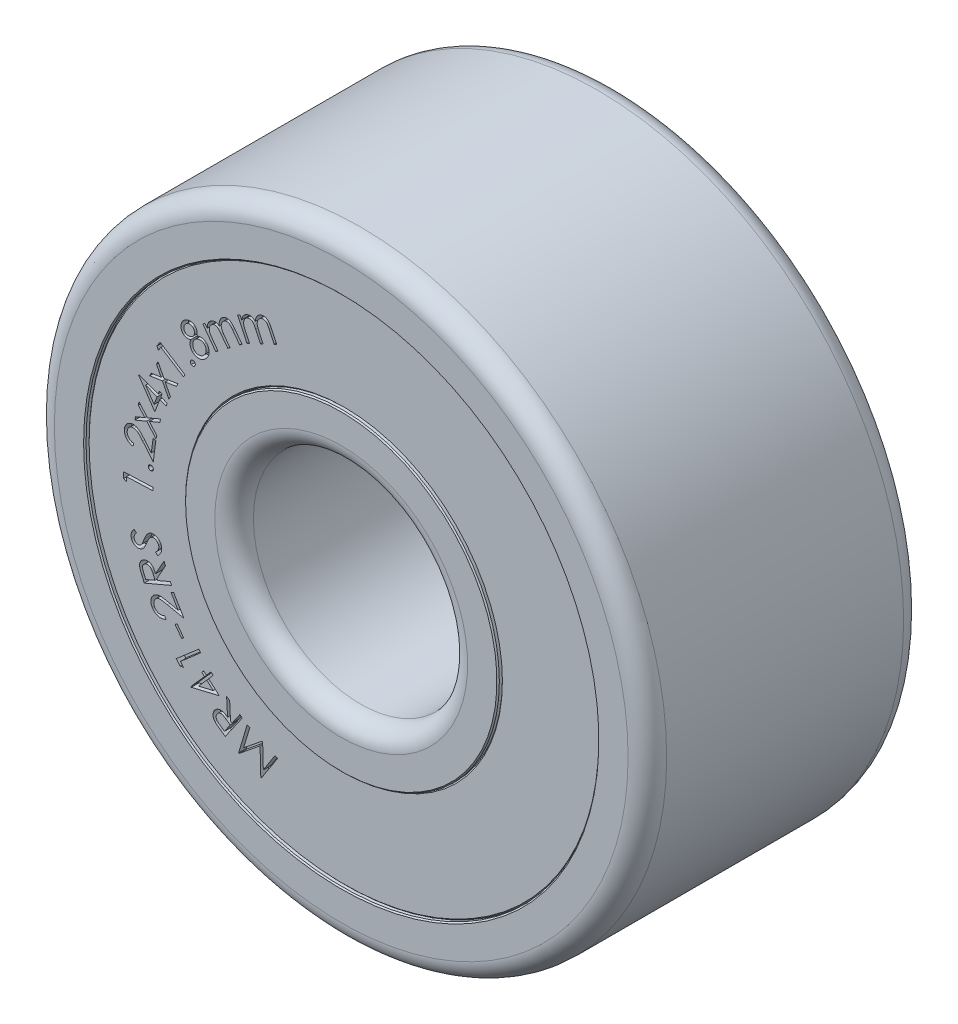
from build123d import *

# Parameters (mm, degrees)
SKETCH_R_INNER_BODY_W          = 1.8
SKETCH_R_INNER_BODY_H          = 0.325
FILLET_INNER_BODY_R            = 0.126
CHAMFER_INNER_BODY_SIZE        = 0.008
SKETCH_R_OUTER_BODY_W          = 1.8
SKETCH_R_OUTER_BODY_H          = 0.325
FILLET_OUTER_BODY_R            = 0.126
CHAMFER_OUTER_BODY_SIZE        = 0.008
SKETCH_R_SEAL_FACES_W          = 1.76
SKETCH_R_SEAL_FACES_H          = 0.65
CHAMFER_SEALS_SIZE             = 0.008
CUT_EXTRUDE_SEAL_LABEL_1_DEPTH = 0.05
CUT_EXTRUDE_SEAL_LABEL_2_DEPTH = 0.05


with BuildPart() as part:
    # Sketch R, INNER BODY → Revolve INNER BODY (revolve)
    with BuildSketch(Plane(origin=(0, 0, 0), x_dir=(0, 0, -1), z_dir=(1, 0, 0)), mode=Mode.PRIVATE) as revolve_inner_body_sk:
        with Locations((0, 0.8625)):
            Rectangle(SKETCH_R_INNER_BODY_W, SKETCH_R_INNER_BODY_H)
    revolve(revolve_inner_body_sk.sketch.rotate(Axis((0, 0, 17.5), (0, 0, -1)), 90), axis=Axis((0, 0, 17.5), (0, 0, -1)))

    # Fillet INNER BODY
    fillet_inner_body_edges = [part.edges().sort_by_distance(p)[0] for p in [
        (-0.7, 0, -0.9),
        (-0.7, 0, 0.9),
    ]]
    fillet(fillet_inner_body_edges, radius=FILLET_INNER_BODY_R)

    # Chamfer INNER BODY
    chamfer_inner_body_edges = [part.edges().sort_by_distance(p)[0] for p in [
        (-1.025, 0, 0.9),
        (-1.025, 0, -0.9),
    ]]
    chamfer(chamfer_inner_body_edges, length=CHAMFER_INNER_BODY_SIZE)


with BuildPart() as body_2:
    # Sketch R, OUTER BODY → Revolve OUTER BODY (revolve)
    with BuildSketch(Plane(origin=(0, 0, 0), x_dir=(0, 0, -1), z_dir=(1, 0, 0)), mode=Mode.PRIVATE) as revolve_outer_body_sk:
        with Locations((0, 1.8375)):
            Rectangle(SKETCH_R_OUTER_BODY_W, SKETCH_R_OUTER_BODY_H)
    revolve(revolve_outer_body_sk.sketch.rotate(Axis((0, 0, 17.5), (0, 0, -1)), 90), axis=Axis((0, 0, 17.5), (0, 0, -1)))

    # Fillet OUTER BODY
    fillet_outer_body_edges = [body_2.edges().sort_by_distance(p)[0] for p in [
        (-2, 0, 0.9),
        (-2, 0, -0.9),
    ]]
    fillet(fillet_outer_body_edges, radius=FILLET_OUTER_BODY_R)

    # Chamfer OUTER BODY
    chamfer_outer_body_edges = [body_2.edges().sort_by_distance(p)[0] for p in [
        (-1.675, 0, -0.9),
        (-1.675, 0, 0.9),
    ]]
    chamfer(chamfer_outer_body_edges, length=CHAMFER_OUTER_BODY_SIZE)


with BuildPart() as body_3:
    # Sketch R, SEAL FACES → Revolve SEALS (revolve)
    with BuildSketch(Plane(origin=(0, 0, 0), x_dir=(0, 0, -1), z_dir=(1, 0, 0)), mode=Mode.PRIVATE) as revolve_seals_sk:
        with Locations((0, 1.35)):
            Rectangle(SKETCH_R_SEAL_FACES_W, SKETCH_R_SEAL_FACES_H)
    revolve(revolve_seals_sk.sketch.rotate(Axis((0, 0, 17.5), (0, 0, -1)), 270), axis=Axis((0, 0, 17.5), (0, 0, -1)))

    # Chamfer SEALS
    chamfer_seals_edges = [body_3.edges().sort_by_distance(p)[0] for p in [
        (1.025, 0, -0.88),
        (1.025, 0, 0.88),
        (1.675, 0, 0.88),
        (1.675, 0, -0.88),
    ]]
    chamfer(chamfer_seals_edges, length=CHAMFER_SEALS_SIZE)

    # Sketch TEXT RADIUS 1 — MANUALLY ASSIGN TEXT AND FONT SIZE (FROM EQUATIONS) → Cut-Extrude SEAL LABEL 1 (cut)
    # profile 1 of 19: a face of its own
    with BuildSketch(Plane.XY.offset(0.88)):
        with BuildLine():
            Line((-0.697111191, 1.206639705), (-0.680509629, 1.214413143))
            Line((-0.680509629, 1.214413143), (-0.669962754, 1.191913143))
            add(Edge.make_bspline(
                [(-0.669962754, 1.191913143), (-0.669448735, 1.194554488), (-0.668466992, 1.199599289), (-0.666332124, 1.2066823), (-0.663828886, 1.213003689), (-0.66161166, 1.216728824), (-0.660548691, 1.218514705)],
                knots=[0, 0, 0, 0, 1.136445856, 2.170539126, 3.122931411, 4, 4, 4, 4], degree=3))
            add(Edge.make_bspline(
                [(-0.660548691, 1.218514705), (-0.658996693, 1.220689927), (-0.65593897, 1.224975514), (-0.650324386, 1.230417975), (-0.644254325, 1.23518062), (-0.639707103, 1.237504171), (-0.637423691, 1.238670955)],
                knots=[0, 0, 0, 0, 1.030723876, 2.030715377, 3.011113351, 4, 4, 4, 4], degree=3))
            add(Edge.make_bspline(
                [(-0.637423691, 1.238670955), (-0.635847952, 1.239355634), (-0.632714251, 1.240717269), (-0.627811385, 1.242153573), (-0.622808434, 1.243055273), (-0.617768732, 1.243442268), (-0.612810382, 1.243323988), (-0.608039386, 1.242755542), (-0.603513187, 1.241658864), (-0.599160158, 1.240016704), (-0.594851637, 1.237775891), (-0.590499314, 1.234801974), (-0.586056436, 1.231068469), (-0.583183727, 1.228211712), (-0.581681504, 1.22671783)],
                knots=[0, 0, 0, 0, 1.005767313, 2.000188725, 2.984730366, 3.979327312, 4.956006379, 5.886085135, 6.788957225, 7.677308091, 8.605319933, 9.627215446, 10.759201767, 12, 12, 12, 12], degree=3))
            add(Edge.make_bspline(
                [(-0.581681504, 1.22671783), (-0.581557204, 1.228295436), (-0.581312962, 1.231395334), (-0.580625583, 1.235956755), (-0.579757643, 1.240362683), (-0.578564907, 1.244578651), (-0.577191168, 1.248636518), (-0.575616084, 1.252545702), (-0.573709056, 1.256251932), (-0.57099451, 1.260968619), (-0.567012744, 1.266350162), (-0.561525166, 1.272034768), (-0.555281748, 1.27681742), (-0.550653735, 1.279218897), (-0.548322129, 1.280428768)],
                knots=[0, 0, 0, 0, 0.856908743, 1.683773241, 2.497081416, 3.287625216, 4.054859067, 4.817117057, 5.567802098, 6.310526591, 7.763473218, 9.179946501, 10.57924892, 12, 12, 12, 12], degree=3))
            add(Edge.make_bspline(
                [(-0.548322129, 1.280428768), (-0.546093559, 1.281382493), (-0.541733439, 1.283248423), (-0.534884725, 1.284846111), (-0.528052969, 1.285402851), (-0.521266799, 1.284938819), (-0.514665489, 1.283437552), (-0.508306748, 1.281019382), (-0.502391836, 1.277454557), (-0.49772577, 1.273785124), (-0.494192048, 1.27021654), (-0.491444842, 1.267088445), (-0.488723672, 1.26346428), (-0.485944247, 1.259407415), (-0.483197514, 1.25485924), (-0.480367042, 1.249899075), (-0.477573668, 1.244461533), (-0.475748235, 1.240667394), (-0.474806504, 1.238710018)],
                knots=[0, 0, 0, 0, 1.207538779, 2.362508116, 3.490021574, 4.616561488, 5.741827035, 6.856523467, 7.995154324, 9.17404587, 9.807948123, 10.498501778, 11.249478439, 12.067507475, 12.951012156, 13.899388034, 14.916305156, 16, 16, 16, 16], degree=3))
            Line((-0.474806504, 1.238710018), (-0.441525254, 1.16765533))
            Line((-0.441525254, 1.16765533), (-0.458634629, 1.159647518))
            Line((-0.458634629, 1.159647518), (-0.491915879, 1.230702205))
            add(Edge.make_bspline(
                [(-0.491915879, 1.230702205), (-0.492702876, 1.232372365), (-0.494217161, 1.235585969), (-0.496510732, 1.240151064), (-0.498734955, 1.244249294), (-0.500852391, 1.247892269), (-0.502824368, 1.251106499), (-0.504729682, 1.253855842), (-0.506572111, 1.256127202), (-0.508829534, 1.258578365), (-0.511840734, 1.26099375), (-0.515688422, 1.263388099), (-0.519991954, 1.264951194), (-0.524544491, 1.265988085), (-0.529329967, 1.266293135), (-0.534218206, 1.2658597), (-0.539177331, 1.264620864), (-0.542374718, 1.263272994), (-0.544025254, 1.262577205)],
                knots=[0, 0, 0, 0, 1.26028867, 2.424959346, 3.486876996, 4.442729345, 5.301035869, 6.060503323, 6.724036304, 7.296279004, 8.3319073, 9.34863547, 10.37541519, 11.440712446, 12.527412123, 13.633887642, 14.778580107, 16, 16, 16, 16], degree=3))
            add(Edge.make_bspline(
                [(-0.544025254, 1.262577205), (-0.545992221, 1.261560352), (-0.549881799, 1.259549577), (-0.555006751, 1.255415557), (-0.55947916, 1.250571584), (-0.563147496, 1.244983331), (-0.566052189, 1.23892089), (-0.567976274, 1.232473408), (-0.568963175, 1.225752038), (-0.568960976, 1.219915987), (-0.568394755, 1.214947136), (-0.56753735, 1.210767096), (-0.56636796, 1.206147483), (-0.564776839, 1.201098192), (-0.562835948, 1.195607505), (-0.560450557, 1.189701712), (-0.55778728, 1.183339016), (-0.555772126, 1.179002821), (-0.554728379, 1.176756893)],
                knots=[0, 0, 0, 0, 1.082217008, 2.140028542, 3.205292986, 4.300233275, 5.401433909, 6.486972192, 7.58285938, 8.71810778, 9.334382817, 10.029826271, 10.806347976, 11.667728838, 12.621865624, 13.658155093, 14.78704371, 16, 16, 16, 16], degree=3))
            Line((-0.554728379, 1.176756893), (-0.530861191, 1.12578033))
            Line((-0.530861191, 1.12578033), (-0.547501816, 1.118006893))
            Line((-0.547501816, 1.118006893), (-0.578712754, 1.184647518))
            add(Edge.make_bspline(
                [(-0.578712754, 1.184647518), (-0.579602274, 1.186526891), (-0.581308945, 1.190132735), (-0.583899497, 1.195238145), (-0.586294267, 1.199857399), (-0.588617165, 1.203938664), (-0.590782925, 1.207514048), (-0.59279921, 1.210585945), (-0.594727379, 1.213111076), (-0.59707674, 1.215786147), (-0.600123124, 1.218526735), (-0.604156734, 1.221037236), (-0.60852653, 1.222911687), (-0.613207062, 1.224071135), (-0.618085592, 1.22450982), (-0.623050294, 1.22413115), (-0.628072651, 1.223014409), (-0.6312833, 1.221641414), (-0.632931504, 1.22093658)],
                knots=[0, 0, 0, 0, 1.333306128, 2.558137195, 3.671161392, 4.669568794, 5.568888951, 6.351652075, 7.024693455, 7.604400866, 8.633448854, 9.638919357, 10.63774567, 11.670580913, 12.718361764, 13.764810914, 14.852553808, 16, 16, 16, 16], degree=3))
            add(Edge.make_bspline(
                [(-0.632931504, 1.22093658), (-0.634803609, 1.21995296), (-0.638517114, 1.218001853), (-0.643481907, 1.214019405), (-0.647820917, 1.209264268), (-0.651521925, 1.203804793), (-0.654425948, 1.197815703), (-0.656514439, 1.191462055), (-0.657540542, 1.184779308), (-0.657659469, 1.178996687), (-0.657174941, 1.174122641), (-0.656509866, 1.170101028), (-0.655479148, 1.165759638), (-0.654094697, 1.161114412), (-0.652399946, 1.15614223), (-0.650414207, 1.150832058), (-0.648066402, 1.145204338), (-0.646303646, 1.141386606), (-0.645392441, 1.139413143)],
                knots=[0, 0, 0, 0, 1.088591578, 2.159329165, 3.261934473, 4.398035035, 5.548256539, 6.684357101, 7.833578523, 9.022298784, 9.656392443, 10.357391492, 11.122927435, 11.95585434, 12.856211277, 13.831547555, 14.879082755, 16, 16, 16, 16], degree=3))
            Line((-0.645392441, 1.139413143), (-0.619533066, 1.084256893))
            Line((-0.619533066, 1.084256893), (-0.636134629, 1.076483455))
            Line((-0.636134629, 1.076483455), (-0.697111191, 1.206639705))
        make_face()
    # profile 2 of 19: a face of its own
    with BuildSketch(Plane.XY.offset(0.88)):
        with BuildLine():
            Line((-0.924466528, 1.041378299), (-0.909896216, 1.052276736))
            Line((-0.909896216, 1.052276736), (-0.895169653, 1.032550174))
            add(Edge.make_bspline(
                [(-0.895169653, 1.032550174), (-0.895190416, 1.03520825), (-0.895230188, 1.040299852), (-0.894545487, 1.04760355), (-0.893386831, 1.054242799), (-0.892002534, 1.058305524), (-0.891341528, 1.060245486)],
                knots=[0, 0, 0, 0, 1.133420946, 2.171091659, 3.126691312, 4, 4, 4, 4], degree=3))
            add(Edge.make_bspline(
                [(-0.891341528, 1.060245486), (-0.890265837, 1.062679131), (-0.888154506, 1.067455814), (-0.883820096, 1.073893164), (-0.878877103, 1.07973134), (-0.874926225, 1.08290852), (-0.872943091, 1.084503299)],
                knots=[0, 0, 0, 0, 1.034211239, 2.029917185, 3.011121626, 4, 4, 4, 4], degree=3))
            add(Edge.make_bspline(
                [(-0.872943091, 1.084503299), (-0.871541984, 1.085482476), (-0.868769391, 1.087420129), (-0.864303157, 1.089814817), (-0.859648947, 1.091742607), (-0.854822977, 1.093132115), (-0.84996756, 1.094025125), (-0.845203213, 1.094438105), (-0.840572549, 1.094287327), (-0.836021382, 1.093563382), (-0.831386297, 1.092241617), (-0.826581945, 1.090193349), (-0.821463369, 1.087539184), (-0.818105245, 1.085318211), (-0.816341528, 1.084151736)],
                knots=[0, 0, 0, 0, 1.007735125, 1.994165164, 2.982746373, 3.974605085, 4.95093366, 5.891241037, 6.790522168, 7.677082048, 8.603512504, 9.626358687, 10.753341915, 12, 12, 12, 12], degree=3))
            add(Edge.make_bspline(
                [(-0.816341528, 1.084151736), (-0.816541873, 1.085712336), (-0.816934931, 1.088774079), (-0.817208299, 1.093340896), (-0.817193779, 1.097786943), (-0.816996003, 1.102123208), (-0.816417533, 1.106332369), (-0.815642164, 1.110427796), (-0.814645876, 1.114435888), (-0.81286719, 1.119541678), (-0.810095391, 1.125569382), (-0.805873482, 1.132184951), (-0.800770188, 1.138084561), (-0.796757323, 1.141368176), (-0.794739966, 1.143018924)],
                knots=[0, 0, 0, 0, 0.858955011, 1.685184677, 2.495694609, 3.286027423, 4.053253289, 4.813197296, 5.56157936, 6.305795905, 7.762719478, 9.172851023, 10.578728335, 12, 12, 12, 12], degree=3))
            add(Edge.make_bspline(
                [(-0.794739966, 1.143018924), (-0.792772105, 1.144396142), (-0.788916092, 1.147094793), (-0.782585518, 1.150023859), (-0.776062595, 1.151985514), (-0.769365028, 1.152871887), (-0.762634862, 1.152763816), (-0.755993681, 1.15161599), (-0.749503021, 1.149426205), (-0.744262599, 1.146743514), (-0.74008605, 1.144009136), (-0.736809866, 1.141488005), (-0.733397776, 1.138562577), (-0.729940729, 1.135121506), (-0.726300356, 1.131319828), (-0.722605596, 1.127020412), (-0.718713325, 1.122357772), (-0.716196331, 1.119007347), (-0.714896216, 1.117276736)],
                knots=[0, 0, 0, 0, 1.205226785, 2.361635305, 3.488045489, 4.617189867, 5.74297253, 6.858666852, 7.990671242, 9.173082064, 9.80655761, 10.497650523, 11.249357012, 12.063847033, 12.947999547, 13.894226974, 14.912294806, 16, 16, 16, 16], degree=3))
            Line((-0.714896216, 1.117276736), (-0.668255591, 1.054932986))
            Line((-0.668255591, 1.054932986), (-0.683255591, 1.043682986))
            Line((-0.683255591, 1.043682986), (-0.729896216, 1.106026736))
            add(Edge.make_bspline(
                [(-0.729896216, 1.106026736), (-0.731015575, 1.10748526), (-0.733162509, 1.110282713), (-0.736261251, 1.114308388), (-0.739280338, 1.117823232), (-0.742036993, 1.12099026), (-0.7446604, 1.123657852), (-0.747033618, 1.125984694), (-0.749303467, 1.12779256), (-0.751977359, 1.129741518), (-0.755386531, 1.13150985), (-0.759634921, 1.132990845), (-0.764124067, 1.133716157), (-0.76876103, 1.133811925), (-0.773458615, 1.133119234), (-0.778132391, 1.131766487), (-0.782666977, 1.129512171), (-0.785504656, 1.127572738), (-0.786966528, 1.126573611)],
                knots=[0, 0, 0, 0, 1.264246233, 2.424827156, 3.492077075, 4.449714442, 5.310787415, 6.064384168, 6.732749035, 7.304130694, 8.337418261, 9.35951332, 10.385404874, 11.450963578, 12.536052193, 13.638000124, 14.783180807, 16, 16, 16, 16], degree=3))
            add(Edge.make_bspline(
                [(-0.786966528, 1.126573611), (-0.788669008, 1.125179743), (-0.792033452, 1.122425179), (-0.796212112, 1.117401001), (-0.799570688, 1.111787773), (-0.802044533, 1.105642422), (-0.803610377, 1.099153865), (-0.804204895, 1.092504238), (-0.803785556, 1.085771625), (-0.802661946, 1.080096388), (-0.801102535, 1.075383254), (-0.799428035, 1.07148662), (-0.797365925, 1.067224093), (-0.794786369, 1.062643208), (-0.791790516, 1.057705449), (-0.788334175, 1.052419074), (-0.78442613, 1.046792005), (-0.781599349, 1.042972329), (-0.780130591, 1.040987674)],
                knots=[0, 0, 0, 0, 1.083643444, 2.141498219, 3.204743247, 4.299942345, 5.396948953, 6.486972634, 7.581040523, 8.715012129, 9.330600301, 10.027423788, 10.806098678, 11.665986023, 12.620161694, 13.655477599, 14.781816143, 16, 16, 16, 16], degree=3))
            Line((-0.780130591, 1.040987674), (-0.746654028, 0.996261111))
            Line((-0.746654028, 0.996261111), (-0.761263403, 0.985323611))
            Line((-0.761263403, 0.985323611), (-0.805013403, 1.043800174))
            add(Edge.make_bspline(
                [(-0.805013403, 1.043800174), (-0.806258602, 1.045444402), (-0.808645551, 1.048596259), (-0.812152292, 1.053069214), (-0.815482055, 1.057024942), (-0.818496926, 1.0605824), (-0.821381271, 1.063564131), (-0.823923463, 1.066184282), (-0.826313636, 1.068258179), (-0.829143603, 1.070386438), (-0.832669568, 1.072407369), (-0.837073244, 1.074132676), (-0.841718462, 1.075012258), (-0.846483731, 1.075210917), (-0.851302623, 1.074674386), (-0.856043327, 1.073311877), (-0.860679374, 1.071190837), (-0.86351749, 1.069223897), (-0.864974341, 1.068214236)],
                knots=[0, 0, 0, 0, 1.33304068, 2.555335079, 3.672686028, 4.674933858, 5.567841182, 6.353320396, 7.0333571, 7.610657323, 8.639853134, 9.649457979, 10.652906318, 11.680449355, 12.722229329, 13.771831525, 14.856245744, 16, 16, 16, 16], degree=3))
            add(Edge.make_bspline(
                [(-0.864974341, 1.068214236), (-0.866598102, 1.066884141), (-0.869827038, 1.064239174), (-0.873832518, 1.059355002), (-0.877160515, 1.053885726), (-0.879609675, 1.047808407), (-0.881269394, 1.041400526), (-0.881925711, 1.034789804), (-0.881654959, 1.028080242), (-0.880578189, 1.022420621), (-0.879114768, 1.017782949), (-0.877664397, 1.014001485), (-0.875772808, 1.010015513), (-0.8735374, 1.005755182), (-0.870850507, 1.001291971), (-0.867876561, 0.996510171), (-0.86439734, 0.99156499), (-0.861945308, 0.988197573), (-0.860677466, 0.986456424)],
                knots=[0, 0, 0, 0, 1.087835896, 2.163220127, 3.26151542, 4.401791799, 5.553183353, 6.688354921, 7.838951837, 9.029956107, 9.667354108, 10.363101927, 11.131559683, 11.957386405, 12.860855637, 13.836460069, 14.881324443, 16, 16, 16, 16], degree=3))
            Line((-0.860677466, 0.986456424), (-0.824466528, 0.938057986))
            Line((-0.824466528, 0.938057986), (-0.839036841, 0.927159549))
            Line((-0.839036841, 0.927159549), (-0.924466528, 1.041378299))
        make_face()
    # profile 3 of 19: a face of its own
    with BuildSketch(Plane.XY.offset(0.88)):
        with BuildLine():
            add(Edge.make_bspline(
                [(-0.963472747, 0.954821283), (-0.961786914, 0.955415921), (-0.958494764, 0.956577149), (-0.953561938, 0.957912824), (-0.948838556, 0.959026459), (-0.944289724, 0.959836193), (-0.939913516, 0.960238031), (-0.93572452, 0.960439246), (-0.931716444, 0.960215004), (-0.927871523, 0.959771758), (-0.924166975, 0.958967459), (-0.920581068, 0.957911336), (-0.917088187, 0.956624786), (-0.913705249, 0.955065346), (-0.91046885, 0.953160456), (-0.907306686, 0.951056837), (-0.904220067, 0.948716769), (-0.90232456, 0.946935487), (-0.901363372, 0.946032221)],
                knots=[0, 0, 0, 0, 1.287908557, 2.515069266, 3.680545103, 4.785156768, 5.841228177, 6.84602376, 7.804347004, 8.730853456, 9.63270001, 10.532444753, 11.423189118, 12.313241181, 13.212985924, 14.126522896, 15.049982874, 16, 16, 16, 16], degree=3))
            add(Edge.make_bspline(
                [(-0.901363372, 0.946032221), (-0.900063101, 0.94471297), (-0.897494472, 0.942106846), (-0.894101573, 0.937856459), (-0.891091835, 0.93343824), (-0.888601398, 0.928744166), (-0.886473549, 0.923871158), (-0.884825894, 0.918755635), (-0.883657533, 0.913426667), (-0.883197511, 0.909786611), (-0.882964934, 0.907946283)],
                knots=[0, 0, 0, 0, 1.027799095, 2.030372912, 3.01485147, 3.991655742, 4.976028122, 5.963660242, 6.970473511, 8, 8, 8, 8], degree=3))
            add(Edge.make_bspline(
                [(-0.882964934, 0.907946283), (-0.882814005, 0.905667711), (-0.882514363, 0.901144018), (-0.883123537, 0.89437627), (-0.884423373, 0.887714511), (-0.886671416, 0.881192602), (-0.889653128, 0.87476449), (-0.893433286, 0.868431082), (-0.898076794, 0.862243901), (-0.901641631, 0.858346607), (-0.903472747, 0.856344721)],
                knots=[0, 0, 0, 0, 0.953812174, 1.893622043, 2.832437295, 3.786529284, 4.77091548, 5.791760922, 6.865714374, 8, 8, 8, 8], degree=3))
            add(Edge.make_bspline(
                [(-0.903472747, 0.856344721), (-0.905317797, 0.854502358), (-0.908905057, 0.850920325), (-0.914640145, 0.846226622), (-0.920418672, 0.842232793), (-0.92632722, 0.839058513), (-0.932277069, 0.83655259), (-0.938339224, 0.834851884), (-0.94448372, 0.833962339), (-0.950628261, 0.833775407), (-0.956651713, 0.834227597), (-0.962450064, 0.835124497), (-0.967986516, 0.836441392), (-0.973247629, 0.838241796), (-0.978223216, 0.840522571), (-0.98294104, 0.843226074), (-0.987380818, 0.846392475), (-0.990083666, 0.848830745), (-0.991441497, 0.850055658)],
                knots=[0, 0, 0, 0, 1.266579742, 2.462561992, 3.59647481, 4.675293854, 5.716559449, 6.728409658, 7.726310891, 8.72669726, 9.710064929, 10.657909235, 11.575787805, 12.472366989, 13.355920117, 14.231916701, 15.111767949, 16, 16, 16, 16], degree=3))
            add(Edge.make_bspline(
                [(-0.991441497, 0.850055658), (-0.992393852, 0.851005371), (-0.994275685, 0.852881983), (-0.996810684, 0.855907956), (-0.99910507, 0.859039997), (-1.001070681, 0.862331315), (-1.002863546, 0.865702043), (-1.004351084, 0.869232393), (-1.005535397, 0.872900733), (-1.006553095, 0.876683871), (-1.007204774, 0.880634798), (-1.007541362, 0.884774949), (-1.007638252, 0.889109054), (-1.007338089, 0.893649982), (-1.006751192, 0.898384613), (-1.005834138, 0.90332322), (-1.004639401, 0.908464593), (-1.00360852, 0.911922673), (-1.003082122, 0.913688471)],
                knots=[0, 0, 0, 0, 0.940669385, 1.858741902, 2.759010896, 3.654333446, 4.538648278, 5.428717171, 6.330506229, 7.234318062, 8.167456655, 9.127602578, 10.139069935, 11.197849868, 12.308700002, 13.475634622, 14.710985205, 16, 16, 16, 16], degree=3))
            add(Edge.make_bspline(
                [(-1.003082122, 0.913688471), (-1.005554964, 0.912942674), (-1.010353595, 0.911495431), (-1.017581597, 0.91030287), (-1.024519455, 0.910089558), (-1.031128108, 0.910815389), (-1.037318813, 0.912485296), (-1.043098121, 0.914867183), (-1.048412947, 0.918085838), (-1.051493441, 0.920825786), (-1.053043059, 0.922204096)],
                knots=[0, 0, 0, 0, 1.159480013, 2.25000883, 3.27994451, 4.268933258, 5.225258202, 6.150836998, 7.069793235, 8, 8, 8, 8], degree=3))
            add(Edge.make_bspline(
                [(-1.053043059, 0.922204096), (-1.054502024, 0.923736854), (-1.057423055, 0.926805631), (-1.060901153, 0.932254458), (-1.063739936, 0.938258225), (-1.065760013, 0.94483656), (-1.067060232, 0.951757725), (-1.067238092, 0.958871371), (-1.066609032, 0.966062969), (-1.064874669, 0.973208616), (-1.062382969, 0.98023695), (-1.058925107, 0.986893828), (-1.05476679, 0.993226091), (-1.051363532, 0.996985161), (-1.049644622, 0.998883783)],
                knots=[0, 0, 0, 0, 0.894464609, 1.790831397, 2.723385142, 3.700175284, 4.697579048, 5.696338882, 6.704434539, 7.746532455, 8.801970695, 9.855158777, 10.916688731, 12, 12, 12, 12], degree=3))
            add(Edge.make_bspline(
                [(-1.049644622, 0.998883783), (-1.047849569, 1.000623636), (-1.044311437, 1.004052968), (-1.038329494, 1.008344036), (-1.031922678, 1.011806399), (-1.025140512, 1.014405031), (-1.018176136, 1.016157225), (-1.011169139, 1.017061059), (-1.00418742, 1.0169276), (-0.997334357, 1.015871655), (-0.990760855, 1.013964454), (-0.984612452, 1.011306971), (-0.978965876, 1.007857106), (-0.975698261, 1.004951228), (-0.974058684, 1.003493158)],
                knots=[0, 0, 0, 0, 1.07034658, 2.109703534, 3.14351657, 4.184116461, 5.214201858, 6.215180219, 7.203160547, 8.196909166, 9.178944609, 10.128700373, 11.061046168, 12, 12, 12, 12], degree=3))
            add(Edge.make_bspline(
                [(-0.974058684, 1.003493158), (-0.972563523, 1.001946763), (-0.969625218, 0.998907772), (-0.966130611, 0.993686323), (-0.963518523, 0.98809466), (-0.961746912, 0.982146057), (-0.960853492, 0.975815805), (-0.960848095, 0.969121321), (-0.961668716, 0.962038183), (-0.962857093, 0.957284164), (-0.963472747, 0.954821283)],
                knots=[0, 0, 0, 0, 0.981009005, 1.927888642, 2.85383976, 3.790974428, 4.752387502, 5.763513004, 6.841359255, 8, 8, 8, 8], degree=3))
        make_face()
        with BuildLine():
            add(Edge.make_bspline(
                [(-1.036636809, 0.985094721), (-1.037527378, 0.984133581), (-1.039271606, 0.982251138), (-1.041535349, 0.979213441), (-1.043496464, 0.976139757), (-1.045133487, 0.972967516), (-1.046399441, 0.969700121), (-1.047401314, 0.966361932), (-1.048027633, 0.962943116), (-1.048285693, 0.959487839), (-1.048257188, 0.956074882), (-1.047902555, 0.952765554), (-1.047255292, 0.949604348), (-1.046253342, 0.946618223), (-1.045021989, 0.943762042), (-1.043372159, 0.94111717), (-1.041532871, 0.938531886), (-1.040019655, 0.93702769), (-1.039253997, 0.936266596)],
                knots=[0, 0, 0, 0, 1.15433865, 2.260834351, 3.333964318, 4.365785207, 5.401683952, 6.41865032, 7.433996024, 8.458705903, 9.468848007, 10.438530625, 11.388516282, 12.306839735, 13.211212795, 14.122623883, 15.050083688, 16, 16, 16, 16], degree=3))
            add(Edge.make_bspline(
                [(-1.039253997, 0.936266596), (-1.038465338, 0.935540074), (-1.036902503, 0.934100374), (-1.034229558, 0.932354627), (-1.031416093, 0.930848076), (-1.028395276, 0.929686359), (-1.025190565, 0.928808345), (-1.021795828, 0.928292938), (-1.018217848, 0.927994411), (-1.014504052, 0.928094938), (-1.010783977, 0.928480623), (-1.007138971, 0.929125796), (-1.003683825, 0.930158061), (-1.000345747, 0.931442116), (-0.997201522, 0.933105309), (-0.994157912, 0.9350017), (-0.991344575, 0.937304326), (-0.989593564, 0.939001273), (-0.988707122, 0.939860346)],
                knots=[0, 0, 0, 0, 0.91985576, 1.822819397, 2.733650043, 3.658188414, 4.597234449, 5.58309869, 6.604200121, 7.678466156, 8.769438667, 9.816144992, 10.853481942, 11.863180948, 12.88397588, 13.905077312, 14.939453802, 16, 16, 16, 16], degree=3))
            add(Edge.make_bspline(
                [(-0.988707122, 0.939860346), (-0.987645598, 0.941045251), (-0.985534489, 0.943401737), (-0.982947567, 0.947408183), (-0.980871587, 0.951711082), (-0.979352184, 0.956280592), (-0.978417689, 0.960978624), (-0.978086027, 0.965707086), (-0.978438125, 0.970406002), (-0.979479528, 0.974971752), (-0.980966404, 0.979322158), (-0.982955257, 0.983288663), (-0.985255289, 0.986924091), (-0.987224391, 0.988940253), (-0.988199309, 0.989938471)],
                knots=[0, 0, 0, 0, 1.031858906, 2.052114323, 3.084631358, 4.127519129, 5.170646854, 6.187638007, 7.19679436, 8.218555535, 9.22142137, 10.174419232, 11.096140197, 12, 12, 12, 12], degree=3))
            add(Edge.make_bspline(
                [(-0.988199309, 0.989938471), (-0.988912914, 0.990595733), (-0.990336764, 0.991907164), (-0.992752074, 0.993530086), (-0.995298413, 0.994946388), (-0.998001138, 0.996127002), (-1.000869284, 0.997027938), (-1.00390791, 0.997642856), (-1.007107451, 0.998038093), (-1.010439792, 0.998148232), (-1.01385017, 0.997984097), (-1.017244203, 0.99734296), (-1.020595531, 0.996315263), (-1.023909851, 0.994890317), (-1.027179871, 0.993053256), (-1.030409033, 0.99078689), (-1.033610655, 0.988148305), (-1.035612181, 0.986128636), (-1.036636809, 0.985094721)],
                knots=[0, 0, 0, 0, 0.855228407, 1.706431459, 2.560423316, 3.425175034, 4.304844545, 5.208732727, 6.15816582, 7.147191088, 8.148758424, 9.16544486, 10.187056628, 11.237421282, 12.343707668, 13.491485323, 14.715832318, 16, 16, 16, 16], degree=3))
        make_face(mode=Mode.SUBTRACT)
        with BuildLine():
            add(Edge.make_bspline(
                [(-0.975855559, 0.927907221), (-0.976976148, 0.926705669), (-0.979177703, 0.924345051), (-0.981979739, 0.92046223), (-0.984430465, 0.916500493), (-0.986370928, 0.912356974), (-0.987975913, 0.908126898), (-0.98905105, 0.90373005), (-0.989723765, 0.899205315), (-0.989948489, 0.894600795), (-0.989760489, 0.890037013), (-0.989159434, 0.885636716), (-0.988257538, 0.881432739), (-0.986849595, 0.87745412), (-0.985121072, 0.873664104), (-0.982929421, 0.870119796), (-0.980392299, 0.866767176), (-0.978417536, 0.864748988), (-0.977418059, 0.863727533)],
                knots=[0, 0, 0, 0, 1.104564094, 2.170071234, 3.215943379, 4.23493422, 5.244045126, 6.255587629, 7.274164008, 8.318162652, 9.353002588, 10.343104928, 11.303929687, 12.240518041, 13.177434217, 14.101603763, 15.03917524, 16, 16, 16, 16], degree=3))
            add(Edge.make_bspline(
                [(-0.977418059, 0.863727533), (-0.976094649, 0.862555196), (-0.973468687, 0.860229), (-0.968972299, 0.857432188), (-0.96409095, 0.855276634), (-0.958863968, 0.853763746), (-0.953438783, 0.852922442), (-0.947924441, 0.852940918), (-0.942408496, 0.853718505), (-0.936932661, 0.855361916), (-0.931508342, 0.857700622), (-0.926280856, 0.86087292), (-0.921183105, 0.864705891), (-0.918100329, 0.867751712), (-0.916519622, 0.869313471)],
                knots=[0, 0, 0, 0, 0.929155966, 1.843666605, 2.773226794, 3.729578936, 4.699678918, 5.652193434, 6.62130059, 7.62096175, 8.652139125, 9.721587403, 10.831733385, 12, 12, 12, 12], degree=3))
            add(Edge.make_bspline(
                [(-0.916519622, 0.869313471), (-0.915354263, 0.870585629), (-0.913071525, 0.873077567), (-0.910051717, 0.877019691), (-0.907536307, 0.881067042), (-0.905487236, 0.885184695), (-0.903911457, 0.88938578), (-0.902814602, 0.893655503), (-0.902177687, 0.898002834), (-0.902033331, 0.902377034), (-0.902315348, 0.906689442), (-0.902932631, 0.910848088), (-0.903911947, 0.914828457), (-0.90526181, 0.918625187), (-0.907067716, 0.922191334), (-0.909111779, 0.925617638), (-0.911609097, 0.928814717), (-0.91351798, 0.930751017), (-0.914488372, 0.931735346)],
                knots=[0, 0, 0, 0, 1.186233221, 2.323626297, 3.409616508, 4.458948343, 5.481963367, 6.489813583, 7.485293141, 8.497906756, 9.493950119, 10.453994268, 11.385804355, 12.309314614, 13.218470731, 14.130797105, 15.049780325, 16, 16, 16, 16], degree=3))
            add(Edge.make_bspline(
                [(-0.914488372, 0.931735346), (-0.915486658, 0.932628813), (-0.917468007, 0.934402124), (-0.920728092, 0.936675103), (-0.924195401, 0.938549796), (-0.92784251, 0.940112919), (-0.93173936, 0.941172054), (-0.935814438, 0.941934537), (-0.940106848, 0.942260749), (-0.944535739, 0.942270923), (-0.94899332, 0.941881628), (-0.953357206, 0.941117418), (-0.957531122, 0.939883664), (-0.961564869, 0.938330407), (-0.965398858, 0.936311997), (-0.969096256, 0.933920149), (-0.972609817, 0.931110913), (-0.974766977, 0.9289817), (-0.975855559, 0.927907221)],
                knots=[0, 0, 0, 0, 0.944143873, 1.873890351, 2.794295154, 3.720270747, 4.664950254, 5.635687489, 6.639935458, 7.695869773, 8.75578876, 9.791406997, 10.814287625, 11.820297066, 12.834694063, 13.863615014, 14.9219021, 16, 16, 16, 16], degree=3))
        make_face(mode=Mode.SUBTRACT)
    # profile 4 of 19: a face of its own
    with BuildSketch(Plane.XY.offset(0.88)):
        with BuildLine():
            add(Edge.make_bspline(
                [(-1.002246341, 0.797181902), (-1.001538163, 0.797999986), (-1.00014643, 0.79960771), (-0.997489838, 0.801364535), (-0.994580214, 0.802606992), (-0.991432995, 0.803266538), (-0.988201138, 0.80328913), (-0.985038145, 0.802776812), (-0.982049279, 0.801510997), (-0.980296975, 0.800251992), (-0.979394779, 0.799603777)],
                knots=[0, 0, 0, 0, 1.011853265, 1.988524342, 2.958206215, 3.970133346, 4.985010709, 5.977999344, 6.958946718, 8, 8, 8, 8], degree=3))
            add(Edge.make_bspline(
                [(-0.979394779, 0.799603777), (-0.978576548, 0.798895603), (-0.976968536, 0.797503878), (-0.975213811, 0.794847225), (-0.973958316, 0.791926067), (-0.973331155, 0.788763896), (-0.973223779, 0.785529696), (-0.973793911, 0.782403602), (-0.9749134, 0.77941331), (-0.976173319, 0.777703431), (-0.976816654, 0.77683034)],
                knots=[0, 0, 0, 0, 1.016449108, 1.997556229, 2.971642402, 4.000189007, 5.019897872, 6.005300714, 6.981475294, 8, 8, 8, 8], degree=3))
            add(Edge.make_bspline(
                [(-0.976816654, 0.77683034), (-0.977540748, 0.77601563), (-0.978950814, 0.774429106), (-0.981585759, 0.772627884), (-0.984520825, 0.771396453), (-0.987699613, 0.770801608), (-0.990928558, 0.770751657), (-0.994065429, 0.771293815), (-0.997037331, 0.772476315), (-0.998754391, 0.773730469), (-0.999629154, 0.774369402)],
                knots=[0, 0, 0, 0, 1.023463703, 1.993042418, 2.977019127, 4.001657875, 5.019669354, 6.003646062, 6.982949363, 8, 8, 8, 8], degree=3))
            add(Edge.make_bspline(
                [(-0.999629154, 0.774369402), (-1.000457063, 0.775106391), (-1.002069803, 0.77654202), (-1.003899379, 0.779206869), (-1.005171756, 0.782135572), (-1.005827372, 0.785299356), (-1.005863692, 0.788508586), (-1.005316435, 0.791629814), (-1.004139612, 0.794590185), (-1.002885337, 0.796307175), (-1.002246341, 0.797181902)],
                knots=[0, 0, 0, 0, 1.038526765, 2.02301468, 3.009629905, 4.022459589, 5.038242134, 6.008017073, 6.985176192, 8, 8, 8, 8], degree=3))
        make_face()
    # profile 5 of 19: a face of its own
    with BuildSketch(Plane.XY.offset(0.88)):
        Polygon((-1.224059035, 0.767176155), (-1.203746535, 0.79928553), (-1.040348097, 0.69600428), (-1.050621535, 0.67975428), (-1.19804341, 0.772957405), (-1.214254347, 0.747332405), align=None)
    # profile 6 of 19: a face of its own
    with BuildSketch(Plane.XY.offset(0.88)):
        Polygon((-1.271316391, 0.575006092), (-1.261238266, 0.594693592), (-1.196746078, 0.604302967), (-1.226707016, 0.662193592), (-1.216628891, 0.681881092), (-1.178347641, 0.607310779), (-1.086316391, 0.622154529), (-1.096511703, 0.602232654), (-1.170027328, 0.590631092), (-1.136121078, 0.524771717), (-1.146160141, 0.505201404), (-1.188347641, 0.587740467), align=None)
    # profile 7 of 19: a face of its own
    with BuildSketch(Plane.XY.offset(0.88)):
        Polygon((-1.343507881, 0.542869663), (-1.342140693, 0.546580601), (-1.215734443, 0.499041538), (-1.207453193, 0.520994663), (-1.190070381, 0.514471226), (-1.198351631, 0.492518101), (-1.156203193, 0.476658726), (-1.163000068, 0.458533726), (-1.205148506, 0.474393101), (-1.237726631, 0.387713413), align=None)
        Polygon((-1.222531318, 0.480916538), (-1.298117256, 0.509354038), (-1.242609443, 0.427518101), align=None, mode=Mode.SUBTRACT)
    # profile 8 of 19: a face of its own
    with BuildSketch(Plane.XY.offset(0.88)):
        Polygon((-1.36790634, 0.276050953), (-1.362867278, 0.29757439), (-1.302632903, 0.322457203), (-1.34571884, 0.371402515), (-1.340679778, 0.392965015), (-1.285523528, 0.329840015), (-1.199820403, 0.366519703), (-1.204898528, 0.344722828), (-1.273414153, 0.315660328), (-1.22462509, 0.259996265), (-1.229586028, 0.238590015), (-1.290523528, 0.308433765), align=None)
    # profile 9 of 19: a face of its own
    with BuildSketch(Plane.XY.offset(0.88)):
        with BuildLine():
            Line((-1.376957165, 0.139638518), (-1.379418103, 0.121240081))
            add(Edge.make_bspline(
                [(-1.379418103, 0.121240081), (-1.381731117, 0.121670978), (-1.386256959, 0.122514109), (-1.392803076, 0.12440235), (-1.398935516, 0.126837752), (-1.404714269, 0.129711404), (-1.410061578, 0.133155504), (-1.415047134, 0.137050941), (-1.419593376, 0.141522008), (-1.423757052, 0.146389799), (-1.427353049, 0.151650781), (-1.430445627, 0.157113289), (-1.432906587, 0.162782127), (-1.43476451, 0.168644483), (-1.435969179, 0.174698548), (-1.436583152, 0.180936953), (-1.43665395, 0.187376346), (-1.436181681, 0.191698557), (-1.43594154, 0.193896331)],
                knots=[0, 0, 0, 0, 1.100800065, 2.153920616, 3.182652677, 4.185644994, 5.169570119, 6.154702469, 7.141642886, 8.149069156, 9.148147034, 10.119535149, 11.083033707, 12.035209368, 12.992578381, 13.96648681, 14.965992124, 16, 16, 16, 16], degree=3))
            add(Edge.make_bspline(
                [(-1.43594154, 0.193896331), (-1.43560585, 0.196053343), (-1.434948375, 0.200278018), (-1.433271053, 0.206349681), (-1.431181541, 0.212055752), (-1.428542943, 0.217348487), (-1.425450326, 0.222273911), (-1.421830799, 0.22679222), (-1.417707697, 0.230907433), (-1.413139404, 0.234585899), (-1.408316073, 0.23785124), (-1.403268553, 0.240566488), (-1.398110807, 0.242744885), (-1.392843997, 0.24447147), (-1.3874269, 0.245553069), (-1.381893369, 0.246084053), (-1.376239814, 0.24615814), (-1.372462631, 0.245745701), (-1.370550915, 0.245536956)],
                knots=[0, 0, 0, 0, 1.125242719, 2.203874475, 3.243141373, 4.255426281, 5.248635227, 6.237816113, 7.235195177, 8.247480085, 9.259029377, 10.235726247, 11.19881765, 12.144060443, 13.089851942, 14.041563537, 15.008791659, 16, 16, 16, 16], degree=3))
            add(Edge.make_bspline(
                [(-1.370550915, 0.245536956), (-1.367878045, 0.245086686), (-1.362578598, 0.244193944), (-1.354938549, 0.241611705), (-1.347656162, 0.238186799), (-1.341931761, 0.234429134), (-1.337382339, 0.230842691), (-1.333692988, 0.227636229), (-1.329723076, 0.223958394), (-1.32557539, 0.219716575), (-1.321108073, 0.215028225), (-1.316387933, 0.209836259), (-1.311427219, 0.204119698), (-1.308070728, 0.200112543), (-1.306332165, 0.198036956)],
                knots=[0, 0, 0, 0, 1.188707215, 2.356826555, 3.52825813, 4.714611235, 5.354043377, 6.071637886, 6.860592227, 7.729914435, 8.676361207, 9.70450881, 10.811004006, 12, 12, 12, 12], degree=3))
            Line((-1.306332165, 0.198036956), (-1.26109779, 0.143310393))
            Line((-1.26109779, 0.143310393), (-1.249261853, 0.231982268))
            Line((-1.249261853, 0.231982268), (-1.230707165, 0.229521331))
            Line((-1.230707165, 0.229521331), (-1.24812904, 0.099052581))
            Line((-1.24812904, 0.099052581), (-1.317621228, 0.183036956))
            add(Edge.make_bspline(
                [(-1.317621228, 0.183036956), (-1.319304491, 0.18508918), (-1.322533731, 0.189026251), (-1.327329181, 0.1945636), (-1.331724023, 0.199618554), (-1.335821359, 0.204117392), (-1.339623657, 0.208064618), (-1.343063116, 0.211518845), (-1.34624839, 0.214364621), (-1.349936264, 0.217488568), (-1.354535197, 0.220643674), (-1.360317456, 0.22352193), (-1.366347065, 0.225736656), (-1.370547733, 0.2264355), (-1.37266029, 0.226786956)],
                knots=[0, 0, 0, 0, 1.325357552, 2.542620462, 3.657685712, 4.67021744, 5.580741793, 6.394542324, 7.10353818, 7.712933245, 8.807642175, 9.877724496, 10.932686843, 12, 12, 12, 12], degree=3))
            add(Edge.make_bspline(
                [(-1.37266029, 0.226786956), (-1.373999892, 0.226936789), (-1.376635401, 0.227231568), (-1.380575234, 0.227106405), (-1.384417342, 0.226716541), (-1.388157465, 0.22582771), (-1.391809529, 0.224574758), (-1.395378063, 0.222918315), (-1.39886343, 0.220886243), (-1.402194407, 0.218460192), (-1.405348808, 0.215783167), (-1.40811304, 0.212758082), (-1.410659202, 0.209622456), (-1.412742956, 0.206179435), (-1.41458925, 0.202586079), (-1.415951166, 0.198707058), (-1.417137219, 0.194664025), (-1.417562324, 0.191846019), (-1.417777478, 0.190419768)],
                knots=[0, 0, 0, 0, 1.002728494, 1.97274996, 2.92914939, 3.874867982, 4.82870703, 5.800714213, 6.800389538, 7.82858968, 8.866848812, 9.875516058, 10.876695645, 11.869763035, 12.867319156, 13.879848812, 14.926948191, 16, 16, 16, 16], degree=3))
            add(Edge.make_bspline(
                [(-1.417777478, 0.190419768), (-1.41795069, 0.188911466), (-1.418291883, 0.185940431), (-1.418280328, 0.181514915), (-1.417849433, 0.177238599), (-1.417028386, 0.173116627), (-1.415814404, 0.169131295), (-1.414162188, 0.165301935), (-1.412112615, 0.161596267), (-1.409661854, 0.158055535), (-1.406816555, 0.154734218), (-1.403581501, 0.151712964), (-1.400009081, 0.148967837), (-1.396081189, 0.146506506), (-1.391814522, 0.144307006), (-1.387175035, 0.142451397), (-1.382210118, 0.140823304), (-1.378735652, 0.14003965), (-1.376957165, 0.139638518)],
                knots=[0, 0, 0, 0, 1.003733516, 1.977141626, 2.920861994, 3.843268772, 4.753365444, 5.671821854, 6.597200389, 7.550621055, 8.515799421, 9.48477598, 10.47376324, 11.491883725, 12.547504934, 13.644864659, 14.794469216, 16, 16, 16, 16], degree=3))
        make_face()
    # profile 10 of 19: a face of its own
    with BuildSketch(Plane.XY.offset(0.88)):
        with BuildLine():
            add(Edge.make_bspline(
                [(-1.279934325, 0.058111458), (-1.279838897, 0.059201794), (-1.279652995, 0.061325858), (-1.27856586, 0.064325698), (-1.276998187, 0.067092209), (-1.274795435, 0.069459069), (-1.272254681, 0.07148243), (-1.269347632, 0.072846232), (-1.266218448, 0.07368042), (-1.264054373, 0.073717434), (-1.262942138, 0.073736458)],
                knots=[0, 0, 0, 0, 1.020357393, 1.98773949, 2.959716526, 3.977888216, 4.994381019, 5.980993318, 6.962322716, 8, 8, 8, 8], degree=3))
            add(Edge.make_bspline(
                [(-1.262942138, 0.073736458), (-1.261851933, 0.073655717), (-1.259714242, 0.0734974), (-1.25669896, 0.072413865), (-1.253921744, 0.070840175), (-1.251552749, 0.068626998), (-1.249521599, 0.066112164), (-1.248066861, 0.063259559), (-1.247257953, 0.060161873), (-1.247245392, 0.058024882), (-1.247239013, 0.056939583)],
                knots=[0, 0, 0, 0, 1.021889832, 2.003736649, 2.97863482, 3.999866476, 5.02693379, 5.999991081, 6.984269721, 8, 8, 8, 8], degree=3))
            add(Edge.make_bspline(
                [(-1.247239013, 0.056939583), (-1.24734042, 0.055851754), (-1.24753758, 0.053736756), (-1.248542189, 0.050692703), (-1.25023177, 0.04798389), (-1.252409117, 0.045586547), (-1.2549527, 0.043582034), (-1.257833728, 0.042195428), (-1.26093033, 0.0413786), (-1.263067393, 0.041336149), (-1.264153075, 0.041314583)],
                knots=[0, 0, 0, 0, 1.023784316, 1.990479315, 2.978212673, 3.999803946, 5.019710693, 5.998624827, 6.983250071, 8, 8, 8, 8], degree=3))
            add(Edge.make_bspline(
                [(-1.264153075, 0.041314583), (-1.265253786, 0.041416879), (-1.26740635, 0.04161693), (-1.27049396, 0.042614536), (-1.273257273, 0.04425272), (-1.275672446, 0.046409301), (-1.277666353, 0.04895104), (-1.279045712, 0.051820088), (-1.279874683, 0.054900426), (-1.279914154, 0.057025461), (-1.279934325, 0.058111458)],
                knots=[0, 0, 0, 0, 1.033377174, 2.020885145, 3.010425104, 4.021385516, 5.038801117, 6.015324231, 6.985733506, 8, 8, 8, 8], degree=3))
        make_face()
    # profile 11 of 19: a face of its own
    with BuildSketch(Plane.XY.offset(0.88)):
        Polygon((-1.441234941, -0.090901463), (-1.442719316, -0.052776463), (-1.248774003, -0.045315525), (-1.248031816, -0.064573338), (-1.422992753, -0.07133115), (-1.421820878, -0.1017999), align=None)
    # profile 12 of 19: a face of its own
    with BuildSketch(Plane.XY.offset(0.88)):
        with BuildLine():
            Line((-1.219043517, -0.416569169), (-1.23283258, -0.403287919))
            add(Edge.make_bspline(
                [(-1.23283258, -0.403287919), (-1.230776079, -0.401253285), (-1.226837657, -0.39735674), (-1.221776453, -0.39118498), (-1.217663942, -0.385138088), (-1.214563071, -0.379167822), (-1.212466373, -0.373281534), (-1.211428913, -0.367476728), (-1.211377432, -0.361736299), (-1.212165071, -0.358057953), (-1.212559142, -0.356217606)],
                knots=[0, 0, 0, 0, 1.289083894, 2.468735432, 3.55235441, 4.54417579, 5.460342632, 6.326980408, 7.162956369, 8, 8, 8, 8], degree=3))
            add(Edge.make_bspline(
                [(-1.212559142, -0.356217606), (-1.213028594, -0.354680192), (-1.213957751, -0.351637283), (-1.216019828, -0.347335767), (-1.218636985, -0.343379669), (-1.221654391, -0.339714049), (-1.225062482, -0.336512819), (-1.228722795, -0.333775972), (-1.232700859, -0.331756693), (-1.236859448, -0.330313539), (-1.241086475, -0.329411149), (-1.245329702, -0.32909051), (-1.249541274, -0.329349698), (-1.252278829, -0.329969173), (-1.253652892, -0.330280106)],
                knots=[0, 0, 0, 0, 1.070150619, 2.118083618, 3.165010234, 4.224909793, 5.274565777, 6.274254624, 7.259987643, 8.234195718, 9.200838897, 10.131892215, 11.062338812, 12, 12, 12, 12], degree=3))
            add(Edge.make_bspline(
                [(-1.253652892, -0.330280106), (-1.255198025, -0.330789027), (-1.258308346, -0.331813475), (-1.262664449, -0.334329439), (-1.26675807, -0.337574785), (-1.269120859, -0.340240936), (-1.27033258, -0.341608231)],
                knots=[0, 0, 0, 0, 0.951442743, 1.915235687, 2.930859944, 4, 4, 4, 4], degree=3))
            add(Edge.make_bspline(
                [(-1.27033258, -0.341608231), (-1.271192843, -0.342691612), (-1.273003372, -0.34497172), (-1.275555796, -0.348767921), (-1.27812891, -0.353061866), (-1.280797459, -0.357811376), (-1.283426368, -0.363115722), (-1.286167602, -0.368870468), (-1.288899547, -0.375143505), (-1.290668087, -0.379507769), (-1.29158258, -0.381764481)],
                knots=[0, 0, 0, 0, 0.728006359, 1.532179346, 2.405581519, 3.362924917, 4.399008928, 5.521185448, 6.718232696, 8, 8, 8, 8], degree=3))
            add(Edge.make_bspline(
                [(-1.29158258, -0.381764481), (-1.29248267, -0.384008845), (-1.294205689, -0.388305171), (-1.296849661, -0.394376851), (-1.299226368, -0.399866291), (-1.301563441, -0.404657433), (-1.303635364, -0.408873162), (-1.305650331, -0.412402275), (-1.30738808, -0.415382604), (-1.30866381, -0.417035213), (-1.30923883, -0.417780106)],
                knots=[0, 0, 0, 0, 1.443208581, 2.762695055, 3.952665405, 5.01287925, 5.944358317, 6.755085332, 7.438869149, 8, 8, 8, 8], degree=3))
            add(Edge.make_bspline(
                [(-1.30923883, -0.417780106), (-1.310119818, -0.418875934), (-1.311855072, -0.421034351), (-1.314724028, -0.423968942), (-1.317748712, -0.426598231), (-1.320920098, -0.428953708), (-1.324245811, -0.431016233), (-1.327701457, -0.432843945), (-1.331328373, -0.434328951), (-1.333841118, -0.435067081), (-1.335098205, -0.435436356)],
                knots=[0, 0, 0, 0, 1.058218304, 2.084339539, 3.085040883, 4.07332208, 5.055407706, 6.028940901, 7.013909631, 8, 8, 8, 8], degree=3))
            add(Edge.make_bspline(
                [(-1.335098205, -0.435436356), (-1.337107265, -0.435906362), (-1.341064467, -0.436832122), (-1.347113382, -0.437286027), (-1.353082716, -0.436948911), (-1.358918343, -0.435743431), (-1.364557228, -0.433871017), (-1.369829647, -0.431117501), (-1.374762775, -0.427690738), (-1.379268658, -0.423565616), (-1.38323811, -0.418836896), (-1.386619306, -0.413668899), (-1.389330707, -0.408045816), (-1.390564981, -0.404061719), (-1.391191955, -0.402037919)],
                knots=[0, 0, 0, 0, 1.018874712, 2.006855963, 2.987088553, 3.965543824, 4.944761197, 5.915050126, 6.895472952, 7.907061074, 8.925854432, 9.940061133, 10.953613823, 12, 12, 12, 12], degree=3))
            add(Edge.make_bspline(
                [(-1.391191955, -0.402037919), (-1.391711059, -0.399847969), (-1.392742761, -0.395495517), (-1.39316201, -0.388807785), (-1.392771759, -0.382130814), (-1.39173199, -0.376569885), (-1.390398565, -0.372066469), (-1.389008307, -0.36855378), (-1.387308924, -0.36489141), (-1.385293935, -0.361093037), (-1.382917651, -0.357174915), (-1.380271733, -0.353105454), (-1.377246807, -0.348918903), (-1.3750562, -0.346131733), (-1.37392633, -0.344694169)],
                knots=[0, 0, 0, 0, 1.295060887, 2.573889394, 3.844258034, 5.142315494, 5.823679872, 6.548296866, 7.31713936, 8.149627085, 9.024718753, 9.957130513, 10.946330248, 12, 12, 12, 12], degree=3))
            Line((-1.37392633, -0.344694169), (-1.358223205, -0.356803544))
            add(Edge.make_bspline(
                [(-1.358223205, -0.356803544), (-1.359114542, -0.357957798), (-1.360838476, -0.360190239), (-1.363236605, -0.363494922), (-1.365272483, -0.366674588), (-1.367162088, -0.369604802), (-1.368692083, -0.37240108), (-1.370013489, -0.374993176), (-1.371040155, -0.377418885), (-1.372021424, -0.380411308), (-1.372766612, -0.384069984), (-1.373080906, -0.388440334), (-1.372838514, -0.392841328), (-1.372160597, -0.395703995), (-1.371816955, -0.397155106)],
                knots=[0, 0, 0, 0, 1.182564117, 2.287194758, 3.309214205, 4.243718169, 5.113343704, 5.892434917, 6.602271832, 7.246667338, 8.443520655, 9.61851931, 10.792806205, 12, 12, 12, 12], degree=3))
            add(Edge.make_bspline(
                [(-1.371816955, -0.397155106), (-1.371243143, -0.39893947), (-1.37013411, -0.402388195), (-1.367455876, -0.407003532), (-1.364083605, -0.410878684), (-1.360047751, -0.413926185), (-1.35556832, -0.416082331), (-1.350832688, -0.417244702), (-1.345922714, -0.417382227), (-1.342719913, -0.416690239), (-1.341074767, -0.416334794)],
                knots=[0, 0, 0, 0, 1.108334121, 2.142130313, 3.137447595, 4.134528487, 5.118290117, 6.063520727, 7.005311197, 8, 8, 8, 8], degree=3))
            add(Edge.make_bspline(
                [(-1.341074767, -0.416334794), (-1.340077044, -0.416031614), (-1.338080273, -0.415424853), (-1.335235433, -0.414113692), (-1.332511441, -0.412537684), (-1.329870896, -0.410639582), (-1.327346178, -0.408233258), (-1.324848351, -0.40532939), (-1.322388153, -0.4018635), (-1.320861493, -0.399314873), (-1.320059142, -0.397975419)],
                knots=[0, 0, 0, 0, 0.870625758, 1.742406868, 2.610308082, 3.498372997, 4.453014096, 5.517669206, 6.695388174, 8, 8, 8, 8], degree=3))
            add(Edge.make_bspline(
                [(-1.320059142, -0.397975419), (-1.31980893, -0.397481998), (-1.319208261, -0.396297477), (-1.318249103, -0.394197933), (-1.317068599, -0.391474277), (-1.315685687, -0.388131039), (-1.314015742, -0.384176924), (-1.312217134, -0.379573126), (-1.310121711, -0.374379931), (-1.308699895, -0.370698784), (-1.307949767, -0.368756669)],
                knots=[0, 0, 0, 0, 0.419647031, 1.00741852, 1.750595296, 2.671480322, 3.75192343, 5.006517178, 6.420686125, 8, 8, 8, 8], degree=3))
            add(Edge.make_bspline(
                [(-1.307949767, -0.368756669), (-1.307030284, -0.366405468), (-1.305250717, -0.361854952), (-1.302368415, -0.355359281), (-1.299534694, -0.349345345), (-1.296700922, -0.343835259), (-1.293829756, -0.338853619), (-1.291009384, -0.334359181), (-1.288139012, -0.330379839), (-1.285247529, -0.326875018), (-1.282252478, -0.32380208), (-1.27927307, -0.320973664), (-1.276164071, -0.318473788), (-1.273010805, -0.316225847), (-1.26973568, -0.314321507), (-1.266429239, -0.312619394), (-1.263012584, -0.311243632), (-1.26067706, -0.310548609), (-1.259512267, -0.310201981)],
                knots=[0, 0, 0, 0, 1.5351644, 2.971157372, 4.320707689, 5.57801029, 6.73798364, 7.816612825, 8.803435498, 9.719987625, 10.576854382, 11.41162864, 12.216730165, 13.001040422, 13.764280642, 14.518595702, 15.261181471, 16, 16, 16, 16], degree=3))
            add(Edge.make_bspline(
                [(-1.259512267, -0.310201981), (-1.257826756, -0.309787597), (-1.254510394, -0.308972266), (-1.249449801, -0.308394511), (-1.244436404, -0.308360302), (-1.239461901, -0.308827528), (-1.2345247, -0.309814239), (-1.229627776, -0.31134558), (-1.224775643, -0.313442913), (-1.220011317, -0.315992959), (-1.215479382, -0.318980234), (-1.211267178, -0.322309498), (-1.20745838, -0.325988235), (-1.204091749, -0.33002964), (-1.201140027, -0.334404136), (-1.198602031, -0.339099724), (-1.196465773, -0.344136259), (-1.195404028, -0.347664623), (-1.19486383, -0.349459794)],
                knots=[0, 0, 0, 0, 0.991347389, 1.950546046, 2.90325455, 3.852701342, 4.80147693, 5.776058578, 6.779734422, 7.818666186, 8.86113767, 9.878218565, 10.883548821, 11.882244986, 12.87930351, 13.895049134, 14.929037075, 16, 16, 16, 16], degree=3))
            add(Edge.make_bspline(
                [(-1.19486383, -0.349459794), (-1.194500091, -0.35087379), (-1.193781469, -0.353667355), (-1.193152287, -0.357908728), (-1.192740777, -0.362106216), (-1.192650446, -0.366300526), (-1.192950109, -0.370475368), (-1.1934801, -0.37462993), (-1.194353878, -0.378754005), (-1.195528065, -0.382869479), (-1.197040793, -0.38700314), (-1.199050665, -0.39110522), (-1.201323515, -0.395302575), (-1.20410445, -0.399493495), (-1.207254368, -0.403725325), (-1.210804695, -0.408010564), (-1.214727397, -0.412339379), (-1.217583404, -0.41513826), (-1.219043517, -0.416569169)],
                knots=[0, 0, 0, 0, 0.929427359, 1.836226218, 2.727568885, 3.615199219, 4.504571639, 5.391387829, 6.281185573, 7.186921718, 8.115941896, 9.080528313, 10.093978505, 11.154496646, 12.280854818, 13.45326914, 14.698001506, 16, 16, 16, 16], degree=3))
        make_face()
    # profile 13 of 19: a face of its own
    with BuildSketch(Plane.XY.offset(0.88)):
        with BuildLine():
            Line((-1.306578419, -0.61559873), (-1.321695606, -0.580208105))
            add(Edge.make_bspline(
                [(-1.321695606, -0.580208105), (-1.322705648, -0.577841442), (-1.324642021, -0.573304259), (-1.327303585, -0.566742552), (-1.32959852, -0.56073027), (-1.331597761, -0.555302548), (-1.333289302, -0.550448459), (-1.334669366, -0.546157945), (-1.335713849, -0.542422123), (-1.336174074, -0.540093759), (-1.336383106, -0.53903623)],
                knots=[0, 0, 0, 0, 1.410632823, 2.704355677, 3.88154763, 4.938430529, 5.87527263, 6.699259693, 7.40921145, 8, 8, 8, 8], degree=3))
            add(Edge.make_bspline(
                [(-1.336383106, -0.53903623), (-1.336615426, -0.537606941), (-1.337073938, -0.534786051), (-1.337339098, -0.530536874), (-1.337254909, -0.526371433), (-1.33687485, -0.522266415), (-1.336125029, -0.518257893), (-1.335065495, -0.51430927), (-1.333657041, -0.510439367), (-1.331900558, -0.506665855), (-1.32984351, -0.503033171), (-1.327451159, -0.499617307), (-1.324738576, -0.496458894), (-1.321771667, -0.493484639), (-1.318410446, -0.490857116), (-1.314832762, -0.488377607), (-1.310916219, -0.486169738), (-1.308151032, -0.484913874), (-1.306734669, -0.484270605)],
                knots=[0, 0, 0, 0, 1.027165711, 2.027247768, 3.016167845, 3.981625715, 4.949468635, 5.906621241, 6.880050412, 7.868149862, 8.85728578, 9.839143444, 10.822391596, 11.809064124, 12.814935416, 13.845296697, 14.896334539, 16, 16, 16, 16], degree=3))
            add(Edge.make_bspline(
                [(-1.306734669, -0.484270605), (-1.304346406, -0.483348464), (-1.299692401, -0.481551491), (-1.29248705, -0.479956814), (-1.285351471, -0.479494539), (-1.278336725, -0.480033562), (-1.271515321, -0.481592316), (-1.265036738, -0.484235764), (-1.258923291, -0.487907485), (-1.254188641, -0.491769717), (-1.250596081, -0.495431228), (-1.247888051, -0.498570438), (-1.245247443, -0.502094428), (-1.24262271, -0.505976152), (-1.240039885, -0.510231662), (-1.237562601, -0.514911301), (-1.235047591, -0.519921237), (-1.233502721, -0.523442899), (-1.232711231, -0.525247167)],
                knots=[0, 0, 0, 0, 1.276170387, 2.486871096, 3.665434279, 4.831973198, 5.985631036, 7.142668533, 8.308175684, 9.531933185, 10.179727242, 10.86612124, 11.599002729, 12.375675424, 13.203569583, 14.081452565, 15.017062633, 16, 16, 16, 16], degree=3))
            Line((-1.232711231, -0.525247167), (-1.177320606, -0.426028417))
            Line((-1.177320606, -0.426028417), (-1.167945606, -0.448020605))
            Line((-1.167945606, -0.448020605), (-1.223375294, -0.547122167))
            Line((-1.223375294, -0.547122167), (-1.219039356, -0.557278417))
            Line((-1.219039356, -0.557278417), (-1.136383106, -0.52200498))
            Line((-1.136383106, -0.52200498), (-1.128804981, -0.539739355))
            Line((-1.128804981, -0.539739355), (-1.306578419, -0.61559873))
        make_face()
        with BuildLine():
            Line((-1.296734669, -0.59044248), (-1.236344044, -0.56466123))
            Line((-1.236344044, -0.56466123), (-1.249117481, -0.533958105))
            add(Edge.make_bspline(
                [(-1.249117481, -0.533958105), (-1.249734406, -0.532535263), (-1.250930572, -0.529776492), (-1.252801194, -0.525825957), (-1.25468407, -0.522222607), (-1.256451883, -0.51889944), (-1.25830056, -0.515987586), (-1.260094036, -0.513379415), (-1.261893394, -0.511118966), (-1.264194861, -0.508526462), (-1.267276139, -0.505858128), (-1.271283517, -0.503297861), (-1.27561225, -0.5014473), (-1.280206633, -0.500334709), (-1.284903271, -0.499852904), (-1.289627376, -0.500101643), (-1.294325693, -0.501022294), (-1.297322312, -0.502192155), (-1.298844044, -0.50278623)],
                knots=[0, 0, 0, 0, 1.112136323, 2.156339965, 3.133599461, 4.027883292, 4.854368602, 5.605580763, 6.29682836, 6.924962859, 8.089754249, 9.206272467, 10.323259155, 11.448838623, 12.584252035, 13.696858673, 14.830427507, 16, 16, 16, 16], degree=3))
            add(Edge.make_bspline(
                [(-1.298844044, -0.50278623), (-1.300290827, -0.503454463), (-1.303138583, -0.504769771), (-1.306916567, -0.507567709), (-1.3103173, -0.510753201), (-1.313145302, -0.514487424), (-1.315441678, -0.518496994), (-1.317094528, -0.522747626), (-1.317969101, -0.527170593), (-1.318210271, -0.530994048), (-1.317912163, -0.534226648), (-1.317543729, -0.53696166), (-1.316835593, -0.539959971), (-1.316000016, -0.543257287), (-1.314835558, -0.546815441), (-1.313464741, -0.55066417), (-1.311919334, -0.554823531), (-1.310717917, -0.557647776), (-1.310094044, -0.559114355)],
                knots=[0, 0, 0, 0, 1.163876512, 2.290900937, 3.423676036, 4.565798876, 5.705651764, 6.797993955, 7.887962528, 8.995260519, 9.588220945, 10.262300799, 11.014013182, 11.841787634, 12.752269666, 13.753272574, 14.833315955, 16, 16, 16, 16], degree=3))
            Line((-1.310094044, -0.559114355), (-1.296734669, -0.59044248))
        make_face(mode=Mode.SUBTRACT)
    # profile 14 of 19: a face of its own
    with BuildSketch(Plane.XY.offset(0.88)):
        with BuildLine():
            Line((-1.174496626, -0.733333908), (-1.165004438, -0.749349533))
            add(Edge.make_bspline(
                [(-1.165004438, -0.749349533), (-1.167081789, -0.75045703), (-1.171155395, -0.752628792), (-1.177498879, -0.755159702), (-1.183818795, -0.757096632), (-1.19016726, -0.758355004), (-1.196499448, -0.75898459), (-1.202845015, -0.758981546), (-1.20919463, -0.758362783), (-1.215484204, -0.757068221), (-1.221587178, -0.755199636), (-1.22741113, -0.752823898), (-1.232855455, -0.749867717), (-1.237974882, -0.746435423), (-1.242671914, -0.742393974), (-1.247075699, -0.737902681), (-1.25107784, -0.732835187), (-1.253396877, -0.729150651), (-1.254574751, -0.72727922)],
                knots=[0, 0, 0, 0, 1.098770501, 2.15464792, 3.183903116, 4.182149507, 5.172118499, 6.151212818, 7.14118181, 8.146589738, 9.144984308, 10.118472284, 11.078976143, 12.033648296, 12.991414517, 13.967633925, 14.967730978, 16, 16, 16, 16], degree=3))
            add(Edge.make_bspline(
                [(-1.254574751, -0.72727922), (-1.255633966, -0.725367947), (-1.257705443, -0.721630126), (-1.260240568, -0.715855963), (-1.262075541, -0.710062862), (-1.263296499, -0.704265401), (-1.263949131, -0.698468601), (-1.263896331, -0.69266306), (-1.263221274, -0.686864245), (-1.261942856, -0.681131706), (-1.260082813, -0.675587442), (-1.257902789, -0.67028105), (-1.25515272, -0.665385319), (-1.252081862, -0.660770109), (-1.248500532, -0.656542116), (-1.244495583, -0.65267689), (-1.240104261, -0.649100343), (-1.236876966, -0.64708915), (-1.235238813, -0.646068283)],
                knots=[0, 0, 0, 0, 1.124866188, 2.199867614, 3.241047715, 4.248364372, 5.246489787, 6.238855761, 7.231063162, 8.247775411, 9.257053912, 10.239608551, 11.196948641, 12.143521146, 13.090449796, 14.04353047, 15.00690944, 16, 16, 16, 16], degree=3))
            add(Edge.make_bspline(
                [(-1.235238813, -0.646068283), (-1.232859096, -0.644770518), (-1.228126219, -0.642189474), (-1.220533123, -0.639408957), (-1.212643913, -0.6377017), (-1.205826371, -0.637051826), (-1.200027293, -0.636997575), (-1.195130094, -0.637276783), (-1.189718949, -0.637677432), (-1.183796575, -0.638417809), (-1.177374458, -0.639346081), (-1.170435832, -0.640536777), (-1.162985368, -0.641935886), (-1.15785407, -0.643011756), (-1.155199751, -0.643568283)],
                knots=[0, 0, 0, 0, 1.186168962, 2.359099633, 3.527110818, 4.713266067, 5.35210126, 6.065879402, 6.86116656, 7.728516536, 8.679523525, 9.703469199, 10.812049694, 12, 12, 12, 12], degree=3))
            Line((-1.155199751, -0.643568283), (-1.085668501, -0.658490158))
            Line((-1.085668501, -0.658490158), (-1.131449751, -0.581380783))
            Line((-1.131449751, -0.581380783), (-1.115316938, -0.57181047))
            Line((-1.115316938, -0.57181047), (-1.047973188, -0.68524797))
            Line((-1.047973188, -0.68524797), (-1.154770063, -0.662318283))
            add(Edge.make_bspline(
                [(-1.154770063, -0.662318283), (-1.157360345, -0.661767375), (-1.162340947, -0.66070809), (-1.169536174, -0.659245214), (-1.176153147, -0.658041254), (-1.182180629, -0.65704738), (-1.187614729, -0.656312999), (-1.192456607, -0.655744295), (-1.196718219, -0.655418628), (-1.201571794, -0.655301245), (-1.207160701, -0.655679469), (-1.213518212, -0.656993665), (-1.219633164, -0.659019842), (-1.223365423, -0.661085915), (-1.225238813, -0.66212297)],
                knots=[0, 0, 0, 0, 1.319221155, 2.536602363, 3.657467255, 4.66944346, 5.579431546, 6.388850351, 7.097765358, 7.707621251, 8.806576147, 9.878946363, 10.935347328, 12, 12, 12, 12], degree=3))
            add(Edge.make_bspline(
                [(-1.225238813, -0.66212297), (-1.226373313, -0.662843865), (-1.228610316, -0.664265322), (-1.231680816, -0.666747679), (-1.234412921, -0.669496877), (-1.236886771, -0.672472945), (-1.238911953, -0.67578529), (-1.24075907, -0.679268199), (-1.242188346, -0.683054708), (-1.24329968, -0.687030021), (-1.244098414, -0.691103642), (-1.244440705, -0.695188722), (-1.244407971, -0.699230926), (-1.243971208, -0.703233342), (-1.243159102, -0.707205362), (-1.241880067, -0.711117933), (-1.240255291, -0.715019726), (-1.238846363, -0.717501009), (-1.238129438, -0.718763595)],
                knots=[0, 0, 0, 0, 0.998125573, 1.968099792, 2.925790752, 3.87464583, 4.835507557, 5.80470958, 6.800018236, 7.835196379, 8.869243796, 9.879114621, 10.87559796, 11.868081705, 12.866066621, 13.88180521, 14.922168858, 16, 16, 16, 16], degree=3))
            add(Edge.make_bspline(
                [(-1.238129438, -0.718763595), (-1.237318442, -0.720054817), (-1.235732626, -0.722579663), (-1.23300832, -0.726056286), (-1.230029121, -0.729148295), (-1.226828421, -0.731889649), (-1.223389046, -0.734265759), (-1.21972079, -0.736252648), (-1.215804604, -0.737870317), (-1.211681857, -0.739103815), (-1.207383415, -0.739985644), (-1.202955119, -0.740353945), (-1.19842801, -0.740327368), (-1.193813433, -0.739798701), (-1.189099696, -0.738847062), (-1.184286836, -0.737481296), (-1.17938522, -0.735627044), (-1.176153605, -0.734111162), (-1.174496626, -0.733333908)],
                knots=[0, 0, 0, 0, 1.00659343, 1.968284661, 2.911024452, 3.838220579, 4.747088873, 5.66679667, 6.588312031, 7.540535855, 8.505260032, 9.48084749, 10.469874306, 11.490803291, 12.543229666, 13.643009633, 14.791475756, 16, 16, 16, 16], degree=3))
        make_face()
    # profile 15 of 19: a face of its own
    with BuildSketch(Plane.XY.offset(0.88)):
        Polygon((-1.061983869, -0.806651936), (-1.105343244, -0.748253499), (-1.092413556, -0.738644124), (-1.049054181, -0.797042561), align=None)
    # profile 16 of 19: a face of its own
    with BuildSketch(Plane.XY.offset(0.88)):
        Polygon((-1.073033625, -0.967895618), (-1.09811175, -0.938950306), (-0.950885188, -0.811411243), (-0.938228938, -0.826020618), (-1.071041438, -0.941098743), (-1.051002375, -0.964223743), align=None)
    # profile 17 of 19: a face of its own
    with BuildSketch(Plane.XY.offset(0.88)):
        Polygon((-0.999545113, -1.051557223), (-1.002513863, -1.048940035), (-0.913177925, -0.94761191), (-0.930795113, -0.932104098), (-0.918490425, -0.918158785), (-0.900873238, -0.933666598), (-0.87106855, -0.899838473), (-0.8565373, -0.912650973), (-0.886341988, -0.946479098), (-0.8168498, -1.00776816), align=None)
        Polygon((-0.898646675, -0.96042441), (-0.952045113, -1.021010348), (-0.855834175, -0.998197848), align=None, mode=Mode.SUBTRACT)
    # profile 18 of 19: a face of its own
    with BuildSketch(Plane.XY.offset(0.88)):
        with BuildLine():
            Line((-0.777538125, -1.218675562), (-0.809374063, -1.196527124))
            add(Edge.make_bspline(
                [(-0.809374063, -1.196527124), (-0.811502037, -1.195050603), (-0.815583803, -1.19221842), (-0.821351008, -1.188031119), (-0.826553989, -1.184189683), (-0.831133872, -1.180595806), (-0.835194303, -1.177397731), (-0.838651084, -1.17445799), (-0.841518003, -1.171823035), (-0.843158226, -1.170089946), (-0.843905313, -1.169300562)],
                knots=[0, 0, 0, 0, 1.411379911, 2.70723309, 3.883689164, 4.935417016, 5.87955683, 6.699979795, 7.407869096, 8, 8, 8, 8], degree=3))
            add(Edge.make_bspline(
                [(-0.843905313, -1.169300562), (-0.844872675, -1.168194746), (-0.846773156, -1.166022261), (-0.849303485, -1.162558941), (-0.851437081, -1.158938354), (-0.85332519, -1.155247298), (-0.854871958, -1.151422122), (-0.856024465, -1.147477018), (-0.85689312, -1.143417731), (-0.857453792, -1.139265039), (-0.85758789, -1.135068419), (-0.857423587, -1.130879986), (-0.856764427, -1.126742204), (-0.85580799, -1.122629723), (-0.854412235, -1.118570206), (-0.852652747, -1.114565397), (-0.850536872, -1.110564351), (-0.848837633, -1.108023214), (-0.847967813, -1.106722437)],
                knots=[0, 0, 0, 0, 1.035185268, 2.033724283, 3.017350966, 3.994104465, 4.95350348, 5.920378274, 6.886904613, 7.877186723, 8.868955904, 9.842773609, 10.826528707, 11.817023393, 12.815309367, 13.846786545, 14.897795573, 16, 16, 16, 16], degree=3))
            add(Edge.make_bspline(
                [(-0.847967813, -1.106722437), (-0.846432006, -1.104660274), (-0.843426139, -1.100624228), (-0.838105639, -1.095422625), (-0.832254982, -1.091208904), (-0.825986172, -1.08787887), (-0.819319908, -1.085637116), (-0.812387874, -1.084316516), (-0.805205813, -1.084273454), (-0.799082815, -1.084997026), (-0.794065393, -1.086189565), (-0.790084885, -1.087413632), (-0.785942165, -1.088991948), (-0.781619445, -1.090894809), (-0.77714995, -1.093192888), (-0.772506493, -1.09580429), (-0.76770876, -1.098779305), (-0.764497697, -1.100931168), (-0.762850625, -1.102034937)],
                knots=[0, 0, 0, 0, 1.272287489, 2.490109721, 3.668061938, 4.833640943, 5.992203067, 7.139670104, 8.313730943, 9.535373268, 10.184649109, 10.866094771, 11.596855292, 12.379462113, 13.204458168, 14.085303465, 15.01788177, 16, 16, 16, 16], degree=3))
            Line((-0.762850625, -1.102034937), (-0.768670938, -0.987777124))
            Line((-0.768670938, -0.987777124), (-0.748905313, -1.001527124))
            Line((-0.748905313, -1.001527124), (-0.743202188, -1.115706812))
            Line((-0.743202188, -1.115706812), (-0.734061563, -1.122034937))
            Line((-0.734061563, -1.122034937), (-0.682420938, -1.047738062))
            Line((-0.682420938, -1.047738062), (-0.666444375, -1.058870874))
            Line((-0.666444375, -1.058870874), (-0.777538125, -1.218675562))
        make_face()
        with BuildLine():
            Line((-0.782655313, -1.191917749), (-0.744881875, -1.137581812))
            Line((-0.744881875, -1.137581812), (-0.772225625, -1.118284937))
            add(Edge.make_bspline(
                [(-0.772225625, -1.118284937), (-0.773526674, -1.117411203), (-0.776038928, -1.115724073), (-0.779696875, -1.113300483), (-0.783233435, -1.111256165), (-0.786528397, -1.109395191), (-0.789664575, -1.107868682), (-0.792604817, -1.106623892), (-0.795324441, -1.105573778), (-0.798692008, -1.104656435), (-0.802740056, -1.103990737), (-0.807529336, -1.103925823), (-0.812209056, -1.104699146), (-0.816726274, -1.106179979), (-0.820975534, -1.108340268), (-0.824890763, -1.111047282), (-0.82838556, -1.114380843), (-0.830333565, -1.116966213), (-0.831327188, -1.118284937)],
                knots=[0, 0, 0, 0, 1.115875457, 2.154693457, 3.122946767, 4.023365362, 4.848427249, 5.604345247, 6.296587177, 6.921838311, 8.08621893, 9.207970589, 10.315962632, 11.447554072, 12.579373326, 13.698056311, 14.825844071, 16, 16, 16, 16], degree=3))
            add(Edge.make_bspline(
                [(-0.831327188, -1.118284937), (-0.832190495, -1.119628414), (-0.833900924, -1.122290179), (-0.835692489, -1.126665972), (-0.836784303, -1.131225259), (-0.837271236, -1.135893466), (-0.837021297, -1.140536235), (-0.836175275, -1.145050494), (-0.834586983, -1.149309042), (-0.832743127, -1.152702714), (-0.830823227, -1.155353595), (-0.828966922, -1.157431604), (-0.8268279, -1.159672475), (-0.824288892, -1.161982533), (-0.821410435, -1.164415919), (-0.818210388, -1.16702215), (-0.814595108, -1.169643989), (-0.812082994, -1.171449983), (-0.810780313, -1.172386499)],
                knots=[0, 0, 0, 0, 1.15913366, 2.296533709, 3.416947206, 4.558554401, 5.695915057, 6.785677568, 7.884774052, 8.986273025, 9.582717497, 10.260392863, 11.0101956, 11.834188383, 12.754162789, 13.750587856, 14.833545342, 16, 16, 16, 16], degree=3))
            Line((-0.810780313, -1.172386499), (-0.782655313, -1.191917749))
        make_face(mode=Mode.SUBTRACT)
    # profile 19 of 19: a face of its own
    with BuildSketch(Plane.XY.offset(0.88)):
        Polygon((-0.436265808, -1.172785052), (-0.542554871, -1.337199115), (-0.545445496, -1.33587099), (-0.550289246, -1.158449115), (-0.687789246, -1.270128802), (-0.690640808, -1.268800677), (-0.634625183, -1.081144427), (-0.617281433, -1.08915224), (-0.658179871, -1.222980365), (-0.537828308, -1.12587099), (-0.533414246, -1.12790224), (-0.528922058, -1.283800677), (-0.453257996, -1.16493349), align=None)
    extrude(amount=-CUT_EXTRUDE_SEAL_LABEL_1_DEPTH, mode=Mode.SUBTRACT)

    # Sketch TEXT RADIUS 2 — MANUALLY ASSIGN TEXT AND FONT SIZE (FROM EQUATIONS) → Cut-Extrude SEAL LABEL 2 (cut)
    # profile 1 of 19: a face of its own
    with BuildSketch(Plane(origin=(0, 0, -0.88), x_dir=(-1, 0, 0), z_dir=(0, 0, -1))):
        with BuildLine():
            Line((-0.697111191, 1.206639705), (-0.680509629, 1.214413143))
            Line((-0.680509629, 1.214413143), (-0.669962754, 1.191913143))
            add(Edge.make_bspline(
                [(-0.669962754, 1.191913143), (-0.669448735, 1.194554488), (-0.668466992, 1.199599289), (-0.666332124, 1.2066823), (-0.663828886, 1.213003689), (-0.66161166, 1.216728824), (-0.660548691, 1.218514705)],
                knots=[0, 0, 0, 0, 1.136445856, 2.170539126, 3.122931411, 4, 4, 4, 4], degree=3))
            add(Edge.make_bspline(
                [(-0.660548691, 1.218514705), (-0.658996693, 1.220689927), (-0.65593897, 1.224975514), (-0.650324386, 1.230417975), (-0.644254325, 1.23518062), (-0.639707103, 1.237504171), (-0.637423691, 1.238670955)],
                knots=[0, 0, 0, 0, 1.030723876, 2.030715377, 3.011113351, 4, 4, 4, 4], degree=3))
            add(Edge.make_bspline(
                [(-0.637423691, 1.238670955), (-0.635847952, 1.239355634), (-0.632714251, 1.240717269), (-0.627811385, 1.242153573), (-0.622808434, 1.243055273), (-0.617768732, 1.243442268), (-0.612810382, 1.243323988), (-0.608039386, 1.242755542), (-0.603513187, 1.241658864), (-0.599160158, 1.240016704), (-0.594851637, 1.237775891), (-0.590499314, 1.234801974), (-0.586056436, 1.231068469), (-0.583183727, 1.228211712), (-0.581681504, 1.22671783)],
                knots=[0, 0, 0, 0, 1.005767313, 2.000188725, 2.984730366, 3.979327312, 4.956006379, 5.886085135, 6.788957225, 7.677308091, 8.605319933, 9.627215446, 10.759201767, 12, 12, 12, 12], degree=3))
            add(Edge.make_bspline(
                [(-0.581681504, 1.22671783), (-0.581557204, 1.228295436), (-0.581312962, 1.231395334), (-0.580625583, 1.235956755), (-0.579757643, 1.240362683), (-0.578564907, 1.244578651), (-0.577191168, 1.248636518), (-0.575616084, 1.252545702), (-0.573709056, 1.256251932), (-0.57099451, 1.260968619), (-0.567012744, 1.266350162), (-0.561525166, 1.272034768), (-0.555281748, 1.27681742), (-0.550653735, 1.279218897), (-0.548322129, 1.280428768)],
                knots=[0, 0, 0, 0, 0.856908743, 1.683773241, 2.497081416, 3.287625216, 4.054859067, 4.817117057, 5.567802098, 6.310526591, 7.763473218, 9.179946501, 10.57924892, 12, 12, 12, 12], degree=3))
            add(Edge.make_bspline(
                [(-0.548322129, 1.280428768), (-0.546093559, 1.281382493), (-0.541733439, 1.283248423), (-0.534884725, 1.284846111), (-0.528052969, 1.285402851), (-0.521266799, 1.284938819), (-0.514665489, 1.283437552), (-0.508306748, 1.281019382), (-0.502391836, 1.277454557), (-0.49772577, 1.273785124), (-0.494192048, 1.27021654), (-0.491444842, 1.267088445), (-0.488723672, 1.26346428), (-0.485944247, 1.259407415), (-0.483197514, 1.25485924), (-0.480367042, 1.249899075), (-0.477573668, 1.244461533), (-0.475748235, 1.240667394), (-0.474806504, 1.238710018)],
                knots=[0, 0, 0, 0, 1.207538779, 2.362508116, 3.490021574, 4.616561488, 5.741827035, 6.856523467, 7.995154324, 9.17404587, 9.807948123, 10.498501778, 11.249478439, 12.067507475, 12.951012156, 13.899388034, 14.916305156, 16, 16, 16, 16], degree=3))
            Line((-0.474806504, 1.238710018), (-0.441525254, 1.16765533))
            Line((-0.441525254, 1.16765533), (-0.458634629, 1.159647518))
            Line((-0.458634629, 1.159647518), (-0.491915879, 1.230702205))
            add(Edge.make_bspline(
                [(-0.491915879, 1.230702205), (-0.492702876, 1.232372365), (-0.494217161, 1.235585969), (-0.496510732, 1.240151064), (-0.498734955, 1.244249294), (-0.500852391, 1.247892269), (-0.502824368, 1.251106499), (-0.504729682, 1.253855842), (-0.506572111, 1.256127202), (-0.508829534, 1.258578365), (-0.511840734, 1.26099375), (-0.515688422, 1.263388099), (-0.519991954, 1.264951194), (-0.524544491, 1.265988085), (-0.529329967, 1.266293135), (-0.534218206, 1.2658597), (-0.539177331, 1.264620864), (-0.542374718, 1.263272994), (-0.544025254, 1.262577205)],
                knots=[0, 0, 0, 0, 1.26028867, 2.424959346, 3.486876996, 4.442729345, 5.301035869, 6.060503323, 6.724036304, 7.296279004, 8.3319073, 9.34863547, 10.37541519, 11.440712446, 12.527412123, 13.633887642, 14.778580107, 16, 16, 16, 16], degree=3))
            add(Edge.make_bspline(
                [(-0.544025254, 1.262577205), (-0.545992221, 1.261560352), (-0.549881799, 1.259549577), (-0.555006751, 1.255415557), (-0.55947916, 1.250571584), (-0.563147496, 1.244983331), (-0.566052189, 1.23892089), (-0.567976274, 1.232473408), (-0.568963175, 1.225752038), (-0.568960976, 1.219915987), (-0.568394755, 1.214947136), (-0.56753735, 1.210767096), (-0.56636796, 1.206147483), (-0.564776839, 1.201098192), (-0.562835948, 1.195607505), (-0.560450557, 1.189701712), (-0.55778728, 1.183339016), (-0.555772126, 1.179002821), (-0.554728379, 1.176756893)],
                knots=[0, 0, 0, 0, 1.082217008, 2.140028542, 3.205292986, 4.300233275, 5.401433909, 6.486972192, 7.58285938, 8.71810778, 9.334382817, 10.029826271, 10.806347976, 11.667728838, 12.621865624, 13.658155093, 14.78704371, 16, 16, 16, 16], degree=3))
            Line((-0.554728379, 1.176756893), (-0.530861191, 1.12578033))
            Line((-0.530861191, 1.12578033), (-0.547501816, 1.118006893))
            Line((-0.547501816, 1.118006893), (-0.578712754, 1.184647518))
            add(Edge.make_bspline(
                [(-0.578712754, 1.184647518), (-0.579602274, 1.186526891), (-0.581308945, 1.190132735), (-0.583899497, 1.195238145), (-0.586294267, 1.199857399), (-0.588617165, 1.203938664), (-0.590782925, 1.207514048), (-0.59279921, 1.210585945), (-0.594727379, 1.213111076), (-0.59707674, 1.215786147), (-0.600123124, 1.218526735), (-0.604156734, 1.221037236), (-0.60852653, 1.222911687), (-0.613207062, 1.224071135), (-0.618085592, 1.22450982), (-0.623050294, 1.22413115), (-0.628072651, 1.223014409), (-0.6312833, 1.221641414), (-0.632931504, 1.22093658)],
                knots=[0, 0, 0, 0, 1.333306128, 2.558137195, 3.671161392, 4.669568794, 5.568888951, 6.351652075, 7.024693455, 7.604400866, 8.633448854, 9.638919357, 10.63774567, 11.670580913, 12.718361764, 13.764810914, 14.852553808, 16, 16, 16, 16], degree=3))
            add(Edge.make_bspline(
                [(-0.632931504, 1.22093658), (-0.634803609, 1.21995296), (-0.638517114, 1.218001853), (-0.643481907, 1.214019405), (-0.647820917, 1.209264268), (-0.651521925, 1.203804793), (-0.654425948, 1.197815703), (-0.656514439, 1.191462055), (-0.657540542, 1.184779308), (-0.657659469, 1.178996687), (-0.657174941, 1.174122641), (-0.656509866, 1.170101028), (-0.655479148, 1.165759638), (-0.654094697, 1.161114412), (-0.652399946, 1.15614223), (-0.650414207, 1.150832058), (-0.648066402, 1.145204338), (-0.646303646, 1.141386606), (-0.645392441, 1.139413143)],
                knots=[0, 0, 0, 0, 1.088591578, 2.159329165, 3.261934473, 4.398035035, 5.548256539, 6.684357101, 7.833578523, 9.022298784, 9.656392443, 10.357391492, 11.122927435, 11.95585434, 12.856211277, 13.831547555, 14.879082755, 16, 16, 16, 16], degree=3))
            Line((-0.645392441, 1.139413143), (-0.619533066, 1.084256893))
            Line((-0.619533066, 1.084256893), (-0.636134629, 1.076483455))
            Line((-0.636134629, 1.076483455), (-0.697111191, 1.206639705))
        make_face()
    # profile 2 of 19: a face of its own
    with BuildSketch(Plane(origin=(0, 0, -0.88), x_dir=(-1, 0, 0), z_dir=(0, 0, -1))):
        with BuildLine():
            Line((-0.924466528, 1.041378299), (-0.909896216, 1.052276736))
            Line((-0.909896216, 1.052276736), (-0.895169653, 1.032550174))
            add(Edge.make_bspline(
                [(-0.895169653, 1.032550174), (-0.895190416, 1.03520825), (-0.895230188, 1.040299852), (-0.894545487, 1.04760355), (-0.893386831, 1.054242799), (-0.892002534, 1.058305524), (-0.891341528, 1.060245486)],
                knots=[0, 0, 0, 0, 1.133420946, 2.171091659, 3.126691312, 4, 4, 4, 4], degree=3))
            add(Edge.make_bspline(
                [(-0.891341528, 1.060245486), (-0.890265837, 1.062679131), (-0.888154506, 1.067455814), (-0.883820096, 1.073893164), (-0.878877103, 1.07973134), (-0.874926225, 1.08290852), (-0.872943091, 1.084503299)],
                knots=[0, 0, 0, 0, 1.034211239, 2.029917185, 3.011121626, 4, 4, 4, 4], degree=3))
            add(Edge.make_bspline(
                [(-0.872943091, 1.084503299), (-0.871541984, 1.085482476), (-0.868769391, 1.087420129), (-0.864303157, 1.089814817), (-0.859648947, 1.091742607), (-0.854822977, 1.093132115), (-0.84996756, 1.094025125), (-0.845203213, 1.094438105), (-0.840572549, 1.094287327), (-0.836021382, 1.093563382), (-0.831386297, 1.092241617), (-0.826581945, 1.090193349), (-0.821463369, 1.087539184), (-0.818105245, 1.085318211), (-0.816341528, 1.084151736)],
                knots=[0, 0, 0, 0, 1.007735125, 1.994165164, 2.982746373, 3.974605085, 4.95093366, 5.891241037, 6.790522168, 7.677082048, 8.603512504, 9.626358687, 10.753341915, 12, 12, 12, 12], degree=3))
            add(Edge.make_bspline(
                [(-0.816341528, 1.084151736), (-0.816541873, 1.085712336), (-0.816934931, 1.088774079), (-0.817208299, 1.093340896), (-0.817193779, 1.097786943), (-0.816996003, 1.102123208), (-0.816417533, 1.106332369), (-0.815642164, 1.110427796), (-0.814645876, 1.114435888), (-0.81286719, 1.119541678), (-0.810095391, 1.125569382), (-0.805873482, 1.132184951), (-0.800770188, 1.138084561), (-0.796757323, 1.141368176), (-0.794739966, 1.143018924)],
                knots=[0, 0, 0, 0, 0.858955011, 1.685184677, 2.495694609, 3.286027423, 4.053253289, 4.813197296, 5.56157936, 6.305795905, 7.762719478, 9.172851023, 10.578728335, 12, 12, 12, 12], degree=3))
            add(Edge.make_bspline(
                [(-0.794739966, 1.143018924), (-0.792772105, 1.144396142), (-0.788916092, 1.147094793), (-0.782585518, 1.150023859), (-0.776062595, 1.151985514), (-0.769365028, 1.152871887), (-0.762634862, 1.152763816), (-0.755993681, 1.15161599), (-0.749503021, 1.149426205), (-0.744262599, 1.146743514), (-0.74008605, 1.144009136), (-0.736809866, 1.141488005), (-0.733397776, 1.138562577), (-0.729940729, 1.135121506), (-0.726300356, 1.131319828), (-0.722605596, 1.127020412), (-0.718713325, 1.122357772), (-0.716196331, 1.119007347), (-0.714896216, 1.117276736)],
                knots=[0, 0, 0, 0, 1.205226785, 2.361635305, 3.488045489, 4.617189867, 5.74297253, 6.858666852, 7.990671242, 9.173082064, 9.80655761, 10.497650523, 11.249357012, 12.063847033, 12.947999547, 13.894226974, 14.912294806, 16, 16, 16, 16], degree=3))
            Line((-0.714896216, 1.117276736), (-0.668255591, 1.054932986))
            Line((-0.668255591, 1.054932986), (-0.683255591, 1.043682986))
            Line((-0.683255591, 1.043682986), (-0.729896216, 1.106026736))
            add(Edge.make_bspline(
                [(-0.729896216, 1.106026736), (-0.731015575, 1.10748526), (-0.733162509, 1.110282713), (-0.736261251, 1.114308388), (-0.739280338, 1.117823232), (-0.742036993, 1.12099026), (-0.7446604, 1.123657852), (-0.747033618, 1.125984694), (-0.749303467, 1.12779256), (-0.751977359, 1.129741518), (-0.755386531, 1.13150985), (-0.759634921, 1.132990845), (-0.764124067, 1.133716157), (-0.76876103, 1.133811925), (-0.773458615, 1.133119234), (-0.778132391, 1.131766487), (-0.782666977, 1.129512171), (-0.785504656, 1.127572738), (-0.786966528, 1.126573611)],
                knots=[0, 0, 0, 0, 1.264246233, 2.424827156, 3.492077075, 4.449714442, 5.310787415, 6.064384168, 6.732749035, 7.304130694, 8.337418261, 9.35951332, 10.385404874, 11.450963578, 12.536052193, 13.638000124, 14.783180807, 16, 16, 16, 16], degree=3))
            add(Edge.make_bspline(
                [(-0.786966528, 1.126573611), (-0.788669008, 1.125179743), (-0.792033452, 1.122425179), (-0.796212112, 1.117401001), (-0.799570688, 1.111787773), (-0.802044533, 1.105642422), (-0.803610377, 1.099153865), (-0.804204895, 1.092504238), (-0.803785556, 1.085771625), (-0.802661946, 1.080096388), (-0.801102535, 1.075383254), (-0.799428035, 1.07148662), (-0.797365925, 1.067224093), (-0.794786369, 1.062643208), (-0.791790516, 1.057705449), (-0.788334175, 1.052419074), (-0.78442613, 1.046792005), (-0.781599349, 1.042972329), (-0.780130591, 1.040987674)],
                knots=[0, 0, 0, 0, 1.083643444, 2.141498219, 3.204743247, 4.299942345, 5.396948953, 6.486972634, 7.581040523, 8.715012129, 9.330600301, 10.027423788, 10.806098678, 11.665986023, 12.620161694, 13.655477599, 14.781816143, 16, 16, 16, 16], degree=3))
            Line((-0.780130591, 1.040987674), (-0.746654028, 0.996261111))
            Line((-0.746654028, 0.996261111), (-0.761263403, 0.985323611))
            Line((-0.761263403, 0.985323611), (-0.805013403, 1.043800174))
            add(Edge.make_bspline(
                [(-0.805013403, 1.043800174), (-0.806258602, 1.045444402), (-0.808645551, 1.048596259), (-0.812152292, 1.053069214), (-0.815482055, 1.057024942), (-0.818496926, 1.0605824), (-0.821381271, 1.063564131), (-0.823923463, 1.066184282), (-0.826313636, 1.068258179), (-0.829143603, 1.070386438), (-0.832669568, 1.072407369), (-0.837073244, 1.074132676), (-0.841718462, 1.075012258), (-0.846483731, 1.075210917), (-0.851302623, 1.074674386), (-0.856043327, 1.073311877), (-0.860679374, 1.071190837), (-0.86351749, 1.069223897), (-0.864974341, 1.068214236)],
                knots=[0, 0, 0, 0, 1.33304068, 2.555335079, 3.672686028, 4.674933858, 5.567841182, 6.353320396, 7.0333571, 7.610657323, 8.639853134, 9.649457979, 10.652906318, 11.680449355, 12.722229329, 13.771831525, 14.856245744, 16, 16, 16, 16], degree=3))
            add(Edge.make_bspline(
                [(-0.864974341, 1.068214236), (-0.866598102, 1.066884141), (-0.869827038, 1.064239174), (-0.873832518, 1.059355002), (-0.877160515, 1.053885726), (-0.879609675, 1.047808407), (-0.881269394, 1.041400526), (-0.881925711, 1.034789804), (-0.881654959, 1.028080242), (-0.880578189, 1.022420621), (-0.879114768, 1.017782949), (-0.877664397, 1.014001485), (-0.875772808, 1.010015513), (-0.8735374, 1.005755182), (-0.870850507, 1.001291971), (-0.867876561, 0.996510171), (-0.86439734, 0.99156499), (-0.861945308, 0.988197573), (-0.860677466, 0.986456424)],
                knots=[0, 0, 0, 0, 1.087835896, 2.163220127, 3.26151542, 4.401791799, 5.553183353, 6.688354921, 7.838951837, 9.029956107, 9.667354108, 10.363101927, 11.131559683, 11.957386405, 12.860855637, 13.836460069, 14.881324443, 16, 16, 16, 16], degree=3))
            Line((-0.860677466, 0.986456424), (-0.824466528, 0.938057986))
            Line((-0.824466528, 0.938057986), (-0.839036841, 0.927159549))
            Line((-0.839036841, 0.927159549), (-0.924466528, 1.041378299))
        make_face()
    # profile 3 of 19: a face of its own
    with BuildSketch(Plane(origin=(0, 0, -0.88), x_dir=(-1, 0, 0), z_dir=(0, 0, -1))):
        with BuildLine():
            add(Edge.make_bspline(
                [(-0.963472747, 0.954821283), (-0.961786914, 0.955415921), (-0.958494764, 0.956577149), (-0.953561938, 0.957912824), (-0.948838556, 0.959026459), (-0.944289724, 0.959836193), (-0.939913516, 0.960238031), (-0.93572452, 0.960439246), (-0.931716444, 0.960215004), (-0.927871523, 0.959771758), (-0.924166975, 0.958967459), (-0.920581068, 0.957911336), (-0.917088187, 0.956624786), (-0.913705249, 0.955065346), (-0.91046885, 0.953160456), (-0.907306686, 0.951056837), (-0.904220067, 0.948716769), (-0.90232456, 0.946935487), (-0.901363372, 0.946032221)],
                knots=[0, 0, 0, 0, 1.287908557, 2.515069266, 3.680545103, 4.785156768, 5.841228177, 6.84602376, 7.804347004, 8.730853456, 9.63270001, 10.532444753, 11.423189118, 12.313241181, 13.212985924, 14.126522896, 15.049982874, 16, 16, 16, 16], degree=3))
            add(Edge.make_bspline(
                [(-0.901363372, 0.946032221), (-0.900063101, 0.94471297), (-0.897494472, 0.942106846), (-0.894101573, 0.937856459), (-0.891091835, 0.93343824), (-0.888601398, 0.928744166), (-0.886473549, 0.923871158), (-0.884825894, 0.918755635), (-0.883657533, 0.913426667), (-0.883197511, 0.909786611), (-0.882964934, 0.907946283)],
                knots=[0, 0, 0, 0, 1.027799095, 2.030372912, 3.01485147, 3.991655742, 4.976028122, 5.963660242, 6.970473511, 8, 8, 8, 8], degree=3))
            add(Edge.make_bspline(
                [(-0.882964934, 0.907946283), (-0.882814005, 0.905667711), (-0.882514363, 0.901144018), (-0.883123537, 0.89437627), (-0.884423373, 0.887714511), (-0.886671416, 0.881192602), (-0.889653128, 0.87476449), (-0.893433286, 0.868431082), (-0.898076794, 0.862243901), (-0.901641631, 0.858346607), (-0.903472747, 0.856344721)],
                knots=[0, 0, 0, 0, 0.953812174, 1.893622043, 2.832437295, 3.786529284, 4.77091548, 5.791760922, 6.865714374, 8, 8, 8, 8], degree=3))
            add(Edge.make_bspline(
                [(-0.903472747, 0.856344721), (-0.905317797, 0.854502358), (-0.908905057, 0.850920325), (-0.914640145, 0.846226622), (-0.920418672, 0.842232793), (-0.92632722, 0.839058513), (-0.932277069, 0.83655259), (-0.938339224, 0.834851884), (-0.94448372, 0.833962339), (-0.950628261, 0.833775407), (-0.956651713, 0.834227597), (-0.962450064, 0.835124497), (-0.967986516, 0.836441392), (-0.973247629, 0.838241796), (-0.978223216, 0.840522571), (-0.98294104, 0.843226074), (-0.987380818, 0.846392475), (-0.990083666, 0.848830745), (-0.991441497, 0.850055658)],
                knots=[0, 0, 0, 0, 1.266579742, 2.462561992, 3.59647481, 4.675293854, 5.716559449, 6.728409658, 7.726310891, 8.72669726, 9.710064929, 10.657909235, 11.575787805, 12.472366989, 13.355920117, 14.231916701, 15.111767949, 16, 16, 16, 16], degree=3))
            add(Edge.make_bspline(
                [(-0.991441497, 0.850055658), (-0.992393852, 0.851005371), (-0.994275685, 0.852881983), (-0.996810684, 0.855907956), (-0.99910507, 0.859039997), (-1.001070681, 0.862331315), (-1.002863546, 0.865702043), (-1.004351084, 0.869232393), (-1.005535397, 0.872900733), (-1.006553095, 0.876683871), (-1.007204774, 0.880634798), (-1.007541362, 0.884774949), (-1.007638252, 0.889109054), (-1.007338089, 0.893649982), (-1.006751192, 0.898384613), (-1.005834138, 0.90332322), (-1.004639401, 0.908464593), (-1.00360852, 0.911922673), (-1.003082122, 0.913688471)],
                knots=[0, 0, 0, 0, 0.940669385, 1.858741902, 2.759010896, 3.654333446, 4.538648278, 5.428717171, 6.330506229, 7.234318062, 8.167456655, 9.127602578, 10.139069935, 11.197849868, 12.308700002, 13.475634622, 14.710985205, 16, 16, 16, 16], degree=3))
            add(Edge.make_bspline(
                [(-1.003082122, 0.913688471), (-1.005554964, 0.912942674), (-1.010353595, 0.911495431), (-1.017581597, 0.91030287), (-1.024519455, 0.910089558), (-1.031128108, 0.910815389), (-1.037318813, 0.912485296), (-1.043098121, 0.914867183), (-1.048412947, 0.918085838), (-1.051493441, 0.920825786), (-1.053043059, 0.922204096)],
                knots=[0, 0, 0, 0, 1.159480013, 2.25000883, 3.27994451, 4.268933258, 5.225258202, 6.150836998, 7.069793235, 8, 8, 8, 8], degree=3))
            add(Edge.make_bspline(
                [(-1.053043059, 0.922204096), (-1.054502024, 0.923736854), (-1.057423055, 0.926805631), (-1.060901153, 0.932254458), (-1.063739936, 0.938258225), (-1.065760013, 0.94483656), (-1.067060232, 0.951757725), (-1.067238092, 0.958871371), (-1.066609032, 0.966062969), (-1.064874669, 0.973208616), (-1.062382969, 0.98023695), (-1.058925107, 0.986893828), (-1.05476679, 0.993226091), (-1.051363532, 0.996985161), (-1.049644622, 0.998883783)],
                knots=[0, 0, 0, 0, 0.894464609, 1.790831397, 2.723385142, 3.700175284, 4.697579048, 5.696338882, 6.704434539, 7.746532455, 8.801970695, 9.855158777, 10.916688731, 12, 12, 12, 12], degree=3))
            add(Edge.make_bspline(
                [(-1.049644622, 0.998883783), (-1.047849569, 1.000623636), (-1.044311437, 1.004052968), (-1.038329494, 1.008344036), (-1.031922678, 1.011806399), (-1.025140512, 1.014405031), (-1.018176136, 1.016157225), (-1.011169139, 1.017061059), (-1.00418742, 1.0169276), (-0.997334357, 1.015871655), (-0.990760855, 1.013964454), (-0.984612452, 1.011306971), (-0.978965876, 1.007857106), (-0.975698261, 1.004951228), (-0.974058684, 1.003493158)],
                knots=[0, 0, 0, 0, 1.07034658, 2.109703534, 3.14351657, 4.184116461, 5.214201858, 6.215180219, 7.203160547, 8.196909166, 9.178944609, 10.128700373, 11.061046168, 12, 12, 12, 12], degree=3))
            add(Edge.make_bspline(
                [(-0.974058684, 1.003493158), (-0.972563523, 1.001946763), (-0.969625218, 0.998907772), (-0.966130611, 0.993686323), (-0.963518523, 0.98809466), (-0.961746912, 0.982146057), (-0.960853492, 0.975815805), (-0.960848095, 0.969121321), (-0.961668716, 0.962038183), (-0.962857093, 0.957284164), (-0.963472747, 0.954821283)],
                knots=[0, 0, 0, 0, 0.981009005, 1.927888642, 2.85383976, 3.790974428, 4.752387502, 5.763513004, 6.841359255, 8, 8, 8, 8], degree=3))
        make_face()
        with BuildLine():
            add(Edge.make_bspline(
                [(-1.036636809, 0.985094721), (-1.037527378, 0.984133581), (-1.039271606, 0.982251138), (-1.041535349, 0.979213441), (-1.043496464, 0.976139757), (-1.045133487, 0.972967516), (-1.046399441, 0.969700121), (-1.047401314, 0.966361932), (-1.048027633, 0.962943116), (-1.048285693, 0.959487839), (-1.048257188, 0.956074882), (-1.047902555, 0.952765554), (-1.047255292, 0.949604348), (-1.046253342, 0.946618223), (-1.045021989, 0.943762042), (-1.043372159, 0.94111717), (-1.041532871, 0.938531886), (-1.040019655, 0.93702769), (-1.039253997, 0.936266596)],
                knots=[0, 0, 0, 0, 1.15433865, 2.260834351, 3.333964318, 4.365785207, 5.401683952, 6.41865032, 7.433996024, 8.458705903, 9.468848007, 10.438530625, 11.388516282, 12.306839735, 13.211212795, 14.122623883, 15.050083688, 16, 16, 16, 16], degree=3))
            add(Edge.make_bspline(
                [(-1.039253997, 0.936266596), (-1.038465338, 0.935540074), (-1.036902503, 0.934100374), (-1.034229558, 0.932354627), (-1.031416093, 0.930848076), (-1.028395276, 0.929686359), (-1.025190565, 0.928808345), (-1.021795828, 0.928292938), (-1.018217848, 0.927994411), (-1.014504052, 0.928094938), (-1.010783977, 0.928480623), (-1.007138971, 0.929125796), (-1.003683825, 0.930158061), (-1.000345747, 0.931442116), (-0.997201522, 0.933105309), (-0.994157912, 0.9350017), (-0.991344575, 0.937304326), (-0.989593564, 0.939001273), (-0.988707122, 0.939860346)],
                knots=[0, 0, 0, 0, 0.91985576, 1.822819397, 2.733650043, 3.658188414, 4.597234449, 5.58309869, 6.604200121, 7.678466156, 8.769438667, 9.816144992, 10.853481942, 11.863180948, 12.88397588, 13.905077312, 14.939453802, 16, 16, 16, 16], degree=3))
            add(Edge.make_bspline(
                [(-0.988707122, 0.939860346), (-0.987645598, 0.941045251), (-0.985534489, 0.943401737), (-0.982947567, 0.947408183), (-0.980871587, 0.951711082), (-0.979352184, 0.956280592), (-0.978417689, 0.960978624), (-0.978086027, 0.965707086), (-0.978438125, 0.970406002), (-0.979479528, 0.974971752), (-0.980966404, 0.979322158), (-0.982955257, 0.983288663), (-0.985255289, 0.986924091), (-0.987224391, 0.988940253), (-0.988199309, 0.989938471)],
                knots=[0, 0, 0, 0, 1.031858906, 2.052114323, 3.084631358, 4.127519129, 5.170646854, 6.187638007, 7.19679436, 8.218555535, 9.22142137, 10.174419232, 11.096140197, 12, 12, 12, 12], degree=3))
            add(Edge.make_bspline(
                [(-0.988199309, 0.989938471), (-0.988912914, 0.990595733), (-0.990336764, 0.991907164), (-0.992752074, 0.993530086), (-0.995298413, 0.994946388), (-0.998001138, 0.996127002), (-1.000869284, 0.997027938), (-1.00390791, 0.997642856), (-1.007107451, 0.998038093), (-1.010439792, 0.998148232), (-1.01385017, 0.997984097), (-1.017244203, 0.99734296), (-1.020595531, 0.996315263), (-1.023909851, 0.994890317), (-1.027179871, 0.993053256), (-1.030409033, 0.99078689), (-1.033610655, 0.988148305), (-1.035612181, 0.986128636), (-1.036636809, 0.985094721)],
                knots=[0, 0, 0, 0, 0.855228407, 1.706431459, 2.560423316, 3.425175034, 4.304844545, 5.208732727, 6.15816582, 7.147191088, 8.148758424, 9.16544486, 10.187056628, 11.237421282, 12.343707668, 13.491485323, 14.715832318, 16, 16, 16, 16], degree=3))
        make_face(mode=Mode.SUBTRACT)
        with BuildLine():
            add(Edge.make_bspline(
                [(-0.975855559, 0.927907221), (-0.976976148, 0.926705669), (-0.979177703, 0.924345051), (-0.981979739, 0.92046223), (-0.984430465, 0.916500493), (-0.986370928, 0.912356974), (-0.987975913, 0.908126898), (-0.98905105, 0.90373005), (-0.989723765, 0.899205315), (-0.989948489, 0.894600795), (-0.989760489, 0.890037013), (-0.989159434, 0.885636716), (-0.988257538, 0.881432739), (-0.986849595, 0.87745412), (-0.985121072, 0.873664104), (-0.982929421, 0.870119796), (-0.980392299, 0.866767176), (-0.978417536, 0.864748988), (-0.977418059, 0.863727533)],
                knots=[0, 0, 0, 0, 1.104564094, 2.170071234, 3.215943379, 4.23493422, 5.244045126, 6.255587629, 7.274164008, 8.318162652, 9.353002588, 10.343104928, 11.303929687, 12.240518041, 13.177434217, 14.101603763, 15.03917524, 16, 16, 16, 16], degree=3))
            add(Edge.make_bspline(
                [(-0.977418059, 0.863727533), (-0.976094649, 0.862555196), (-0.973468687, 0.860229), (-0.968972299, 0.857432188), (-0.96409095, 0.855276634), (-0.958863968, 0.853763746), (-0.953438783, 0.852922442), (-0.947924441, 0.852940918), (-0.942408496, 0.853718505), (-0.936932661, 0.855361916), (-0.931508342, 0.857700622), (-0.926280856, 0.86087292), (-0.921183105, 0.864705891), (-0.918100329, 0.867751712), (-0.916519622, 0.869313471)],
                knots=[0, 0, 0, 0, 0.929155966, 1.843666605, 2.773226794, 3.729578936, 4.699678918, 5.652193434, 6.62130059, 7.62096175, 8.652139125, 9.721587403, 10.831733385, 12, 12, 12, 12], degree=3))
            add(Edge.make_bspline(
                [(-0.916519622, 0.869313471), (-0.915354263, 0.870585629), (-0.913071525, 0.873077567), (-0.910051717, 0.877019691), (-0.907536307, 0.881067042), (-0.905487236, 0.885184695), (-0.903911457, 0.88938578), (-0.902814602, 0.893655503), (-0.902177687, 0.898002834), (-0.902033331, 0.902377034), (-0.902315348, 0.906689442), (-0.902932631, 0.910848088), (-0.903911947, 0.914828457), (-0.90526181, 0.918625187), (-0.907067716, 0.922191334), (-0.909111779, 0.925617638), (-0.911609097, 0.928814717), (-0.91351798, 0.930751017), (-0.914488372, 0.931735346)],
                knots=[0, 0, 0, 0, 1.186233221, 2.323626297, 3.409616508, 4.458948343, 5.481963367, 6.489813583, 7.485293141, 8.497906756, 9.493950119, 10.453994268, 11.385804355, 12.309314614, 13.218470731, 14.130797105, 15.049780325, 16, 16, 16, 16], degree=3))
            add(Edge.make_bspline(
                [(-0.914488372, 0.931735346), (-0.915486658, 0.932628813), (-0.917468007, 0.934402124), (-0.920728092, 0.936675103), (-0.924195401, 0.938549796), (-0.92784251, 0.940112919), (-0.93173936, 0.941172054), (-0.935814438, 0.941934537), (-0.940106848, 0.942260749), (-0.944535739, 0.942270923), (-0.94899332, 0.941881628), (-0.953357206, 0.941117418), (-0.957531122, 0.939883664), (-0.961564869, 0.938330407), (-0.965398858, 0.936311997), (-0.969096256, 0.933920149), (-0.972609817, 0.931110913), (-0.974766977, 0.9289817), (-0.975855559, 0.927907221)],
                knots=[0, 0, 0, 0, 0.944143873, 1.873890351, 2.794295154, 3.720270747, 4.664950254, 5.635687489, 6.639935458, 7.695869773, 8.75578876, 9.791406997, 10.814287625, 11.820297066, 12.834694063, 13.863615014, 14.9219021, 16, 16, 16, 16], degree=3))
        make_face(mode=Mode.SUBTRACT)
    # profile 4 of 19: a face of its own
    with BuildSketch(Plane(origin=(0, 0, -0.88), x_dir=(-1, 0, 0), z_dir=(0, 0, -1))):
        with BuildLine():
            add(Edge.make_bspline(
                [(-1.002246341, 0.797181902), (-1.001538163, 0.797999986), (-1.00014643, 0.79960771), (-0.997489838, 0.801364535), (-0.994580214, 0.802606992), (-0.991432995, 0.803266538), (-0.988201138, 0.80328913), (-0.985038145, 0.802776812), (-0.982049279, 0.801510997), (-0.980296975, 0.800251992), (-0.979394779, 0.799603777)],
                knots=[0, 0, 0, 0, 1.011853265, 1.988524342, 2.958206215, 3.970133346, 4.985010709, 5.977999344, 6.958946718, 8, 8, 8, 8], degree=3))
            add(Edge.make_bspline(
                [(-0.979394779, 0.799603777), (-0.978576548, 0.798895603), (-0.976968536, 0.797503878), (-0.975213811, 0.794847225), (-0.973958316, 0.791926067), (-0.973331155, 0.788763896), (-0.973223779, 0.785529696), (-0.973793911, 0.782403602), (-0.9749134, 0.77941331), (-0.976173319, 0.777703431), (-0.976816654, 0.77683034)],
                knots=[0, 0, 0, 0, 1.016449108, 1.997556229, 2.971642402, 4.000189007, 5.019897872, 6.005300714, 6.981475294, 8, 8, 8, 8], degree=3))
            add(Edge.make_bspline(
                [(-0.976816654, 0.77683034), (-0.977540748, 0.77601563), (-0.978950814, 0.774429106), (-0.981585759, 0.772627884), (-0.984520825, 0.771396453), (-0.987699613, 0.770801608), (-0.990928558, 0.770751657), (-0.994065429, 0.771293815), (-0.997037331, 0.772476315), (-0.998754391, 0.773730469), (-0.999629154, 0.774369402)],
                knots=[0, 0, 0, 0, 1.023463703, 1.993042418, 2.977019127, 4.001657875, 5.019669354, 6.003646062, 6.982949363, 8, 8, 8, 8], degree=3))
            add(Edge.make_bspline(
                [(-0.999629154, 0.774369402), (-1.000457063, 0.775106391), (-1.002069803, 0.77654202), (-1.003899379, 0.779206869), (-1.005171756, 0.782135572), (-1.005827372, 0.785299356), (-1.005863692, 0.788508586), (-1.005316435, 0.791629814), (-1.004139612, 0.794590185), (-1.002885337, 0.796307175), (-1.002246341, 0.797181902)],
                knots=[0, 0, 0, 0, 1.038526765, 2.02301468, 3.009629905, 4.022459589, 5.038242134, 6.008017073, 6.985176192, 8, 8, 8, 8], degree=3))
        make_face()
    # profile 5 of 19: a face of its own
    with BuildSketch(Plane(origin=(0, 0, -0.88), x_dir=(-1, 0, 0), z_dir=(0, 0, -1))):
        Polygon((-1.224059035, 0.767176155), (-1.203746535, 0.79928553), (-1.040348097, 0.69600428), (-1.050621535, 0.67975428), (-1.19804341, 0.772957405), (-1.214254347, 0.747332405), align=None)
    # profile 6 of 19: a face of its own
    with BuildSketch(Plane(origin=(0, 0, -0.88), x_dir=(-1, 0, 0), z_dir=(0, 0, -1))):
        Polygon((-1.271316391, 0.575006092), (-1.261238266, 0.594693592), (-1.196746078, 0.604302967), (-1.226707016, 0.662193592), (-1.216628891, 0.681881092), (-1.178347641, 0.607310779), (-1.086316391, 0.622154529), (-1.096511703, 0.602232654), (-1.170027328, 0.590631092), (-1.136121078, 0.524771717), (-1.146160141, 0.505201404), (-1.188347641, 0.587740467), align=None)
    # profile 7 of 19: a face of its own
    with BuildSketch(Plane(origin=(0, 0, -0.88), x_dir=(-1, 0, 0), z_dir=(0, 0, -1))):
        Polygon((-1.343507881, 0.542869663), (-1.342140693, 0.546580601), (-1.215734443, 0.499041538), (-1.207453193, 0.520994663), (-1.190070381, 0.514471226), (-1.198351631, 0.492518101), (-1.156203193, 0.476658726), (-1.163000068, 0.458533726), (-1.205148506, 0.474393101), (-1.237726631, 0.387713413), align=None)
        Polygon((-1.222531318, 0.480916538), (-1.298117256, 0.509354038), (-1.242609443, 0.427518101), align=None, mode=Mode.SUBTRACT)
    # profile 8 of 19: a face of its own
    with BuildSketch(Plane(origin=(0, 0, -0.88), x_dir=(-1, 0, 0), z_dir=(0, 0, -1))):
        Polygon((-1.36790634, 0.276050953), (-1.362867278, 0.29757439), (-1.302632903, 0.322457203), (-1.34571884, 0.371402515), (-1.340679778, 0.392965015), (-1.285523528, 0.329840015), (-1.199820403, 0.366519703), (-1.204898528, 0.344722828), (-1.273414153, 0.315660328), (-1.22462509, 0.259996265), (-1.229586028, 0.238590015), (-1.290523528, 0.308433765), align=None)
    # profile 9 of 19: a face of its own
    with BuildSketch(Plane(origin=(0, 0, -0.88), x_dir=(-1, 0, 0), z_dir=(0, 0, -1))):
        with BuildLine():
            Line((-1.376957165, 0.139638518), (-1.379418103, 0.121240081))
            add(Edge.make_bspline(
                [(-1.379418103, 0.121240081), (-1.381731117, 0.121670978), (-1.386256959, 0.122514109), (-1.392803076, 0.12440235), (-1.398935516, 0.126837752), (-1.404714269, 0.129711404), (-1.410061578, 0.133155504), (-1.415047134, 0.137050941), (-1.419593376, 0.141522008), (-1.423757052, 0.146389799), (-1.427353049, 0.151650781), (-1.430445627, 0.157113289), (-1.432906587, 0.162782127), (-1.43476451, 0.168644483), (-1.435969179, 0.174698548), (-1.436583152, 0.180936953), (-1.43665395, 0.187376346), (-1.436181681, 0.191698557), (-1.43594154, 0.193896331)],
                knots=[0, 0, 0, 0, 1.100800065, 2.153920616, 3.182652677, 4.185644994, 5.169570119, 6.154702469, 7.141642886, 8.149069156, 9.148147034, 10.119535149, 11.083033707, 12.035209368, 12.992578381, 13.96648681, 14.965992124, 16, 16, 16, 16], degree=3))
            add(Edge.make_bspline(
                [(-1.43594154, 0.193896331), (-1.43560585, 0.196053343), (-1.434948375, 0.200278018), (-1.433271053, 0.206349681), (-1.431181541, 0.212055752), (-1.428542943, 0.217348487), (-1.425450326, 0.222273911), (-1.421830799, 0.22679222), (-1.417707697, 0.230907433), (-1.413139404, 0.234585899), (-1.408316073, 0.23785124), (-1.403268553, 0.240566488), (-1.398110807, 0.242744885), (-1.392843997, 0.24447147), (-1.3874269, 0.245553069), (-1.381893369, 0.246084053), (-1.376239814, 0.24615814), (-1.372462631, 0.245745701), (-1.370550915, 0.245536956)],
                knots=[0, 0, 0, 0, 1.125242719, 2.203874475, 3.243141373, 4.255426281, 5.248635227, 6.237816113, 7.235195177, 8.247480085, 9.259029377, 10.235726247, 11.19881765, 12.144060443, 13.089851942, 14.041563537, 15.008791659, 16, 16, 16, 16], degree=3))
            add(Edge.make_bspline(
                [(-1.370550915, 0.245536956), (-1.367878045, 0.245086686), (-1.362578598, 0.244193944), (-1.354938549, 0.241611705), (-1.347656162, 0.238186799), (-1.341931761, 0.234429134), (-1.337382339, 0.230842691), (-1.333692988, 0.227636229), (-1.329723076, 0.223958394), (-1.32557539, 0.219716575), (-1.321108073, 0.215028225), (-1.316387933, 0.209836259), (-1.311427219, 0.204119698), (-1.308070728, 0.200112543), (-1.306332165, 0.198036956)],
                knots=[0, 0, 0, 0, 1.188707215, 2.356826555, 3.52825813, 4.714611235, 5.354043377, 6.071637886, 6.860592227, 7.729914435, 8.676361207, 9.70450881, 10.811004006, 12, 12, 12, 12], degree=3))
            Line((-1.306332165, 0.198036956), (-1.26109779, 0.143310393))
            Line((-1.26109779, 0.143310393), (-1.249261853, 0.231982268))
            Line((-1.249261853, 0.231982268), (-1.230707165, 0.229521331))
            Line((-1.230707165, 0.229521331), (-1.24812904, 0.099052581))
            Line((-1.24812904, 0.099052581), (-1.317621228, 0.183036956))
            add(Edge.make_bspline(
                [(-1.317621228, 0.183036956), (-1.319304491, 0.18508918), (-1.322533731, 0.189026251), (-1.327329181, 0.1945636), (-1.331724023, 0.199618554), (-1.335821359, 0.204117392), (-1.339623657, 0.208064618), (-1.343063116, 0.211518845), (-1.34624839, 0.214364621), (-1.349936264, 0.217488568), (-1.354535197, 0.220643674), (-1.360317456, 0.22352193), (-1.366347065, 0.225736656), (-1.370547733, 0.2264355), (-1.37266029, 0.226786956)],
                knots=[0, 0, 0, 0, 1.325357552, 2.542620462, 3.657685712, 4.67021744, 5.580741793, 6.394542324, 7.10353818, 7.712933245, 8.807642175, 9.877724496, 10.932686843, 12, 12, 12, 12], degree=3))
            add(Edge.make_bspline(
                [(-1.37266029, 0.226786956), (-1.373999892, 0.226936789), (-1.376635401, 0.227231568), (-1.380575234, 0.227106405), (-1.384417342, 0.226716541), (-1.388157465, 0.22582771), (-1.391809529, 0.224574758), (-1.395378063, 0.222918315), (-1.39886343, 0.220886243), (-1.402194407, 0.218460192), (-1.405348808, 0.215783167), (-1.40811304, 0.212758082), (-1.410659202, 0.209622456), (-1.412742956, 0.206179435), (-1.41458925, 0.202586079), (-1.415951166, 0.198707058), (-1.417137219, 0.194664025), (-1.417562324, 0.191846019), (-1.417777478, 0.190419768)],
                knots=[0, 0, 0, 0, 1.002728494, 1.97274996, 2.92914939, 3.874867982, 4.82870703, 5.800714213, 6.800389538, 7.82858968, 8.866848812, 9.875516058, 10.876695645, 11.869763035, 12.867319156, 13.879848812, 14.926948191, 16, 16, 16, 16], degree=3))
            add(Edge.make_bspline(
                [(-1.417777478, 0.190419768), (-1.41795069, 0.188911466), (-1.418291883, 0.185940431), (-1.418280328, 0.181514915), (-1.417849433, 0.177238599), (-1.417028386, 0.173116627), (-1.415814404, 0.169131295), (-1.414162188, 0.165301935), (-1.412112615, 0.161596267), (-1.409661854, 0.158055535), (-1.406816555, 0.154734218), (-1.403581501, 0.151712964), (-1.400009081, 0.148967837), (-1.396081189, 0.146506506), (-1.391814522, 0.144307006), (-1.387175035, 0.142451397), (-1.382210118, 0.140823304), (-1.378735652, 0.14003965), (-1.376957165, 0.139638518)],
                knots=[0, 0, 0, 0, 1.003733516, 1.977141626, 2.920861994, 3.843268772, 4.753365444, 5.671821854, 6.597200389, 7.550621055, 8.515799421, 9.48477598, 10.47376324, 11.491883725, 12.547504934, 13.644864659, 14.794469216, 16, 16, 16, 16], degree=3))
        make_face()
    # profile 10 of 19: a face of its own
    with BuildSketch(Plane(origin=(0, 0, -0.88), x_dir=(-1, 0, 0), z_dir=(0, 0, -1))):
        with BuildLine():
            add(Edge.make_bspline(
                [(-1.279934325, 0.058111458), (-1.279838897, 0.059201794), (-1.279652995, 0.061325858), (-1.27856586, 0.064325698), (-1.276998187, 0.067092209), (-1.274795435, 0.069459069), (-1.272254681, 0.07148243), (-1.269347632, 0.072846232), (-1.266218448, 0.07368042), (-1.264054373, 0.073717434), (-1.262942138, 0.073736458)],
                knots=[0, 0, 0, 0, 1.020357393, 1.98773949, 2.959716526, 3.977888216, 4.994381019, 5.980993318, 6.962322716, 8, 8, 8, 8], degree=3))
            add(Edge.make_bspline(
                [(-1.262942138, 0.073736458), (-1.261851933, 0.073655717), (-1.259714242, 0.0734974), (-1.25669896, 0.072413865), (-1.253921744, 0.070840175), (-1.251552749, 0.068626998), (-1.249521599, 0.066112164), (-1.248066861, 0.063259559), (-1.247257953, 0.060161873), (-1.247245392, 0.058024882), (-1.247239013, 0.056939583)],
                knots=[0, 0, 0, 0, 1.021889832, 2.003736649, 2.97863482, 3.999866476, 5.02693379, 5.999991081, 6.984269721, 8, 8, 8, 8], degree=3))
            add(Edge.make_bspline(
                [(-1.247239013, 0.056939583), (-1.24734042, 0.055851754), (-1.24753758, 0.053736756), (-1.248542189, 0.050692703), (-1.25023177, 0.04798389), (-1.252409117, 0.045586547), (-1.2549527, 0.043582034), (-1.257833728, 0.042195428), (-1.26093033, 0.0413786), (-1.263067393, 0.041336149), (-1.264153075, 0.041314583)],
                knots=[0, 0, 0, 0, 1.023784316, 1.990479315, 2.978212673, 3.999803946, 5.019710693, 5.998624827, 6.983250071, 8, 8, 8, 8], degree=3))
            add(Edge.make_bspline(
                [(-1.264153075, 0.041314583), (-1.265253786, 0.041416879), (-1.26740635, 0.04161693), (-1.27049396, 0.042614536), (-1.273257273, 0.04425272), (-1.275672446, 0.046409301), (-1.277666353, 0.04895104), (-1.279045712, 0.051820088), (-1.279874683, 0.054900426), (-1.279914154, 0.057025461), (-1.279934325, 0.058111458)],
                knots=[0, 0, 0, 0, 1.033377174, 2.020885145, 3.010425104, 4.021385516, 5.038801117, 6.015324231, 6.985733506, 8, 8, 8, 8], degree=3))
        make_face()
    # profile 11 of 19: a face of its own
    with BuildSketch(Plane(origin=(0, 0, -0.88), x_dir=(-1, 0, 0), z_dir=(0, 0, -1))):
        Polygon((-1.441234941, -0.090901463), (-1.442719316, -0.052776463), (-1.248774003, -0.045315525), (-1.248031816, -0.064573338), (-1.422992753, -0.07133115), (-1.421820878, -0.1017999), align=None)
    # profile 12 of 19: a face of its own
    with BuildSketch(Plane(origin=(0, 0, -0.88), x_dir=(-1, 0, 0), z_dir=(0, 0, -1))):
        with BuildLine():
            Line((-1.219043517, -0.416569169), (-1.23283258, -0.403287919))
            add(Edge.make_bspline(
                [(-1.23283258, -0.403287919), (-1.230776079, -0.401253285), (-1.226837657, -0.39735674), (-1.221776453, -0.39118498), (-1.217663942, -0.385138088), (-1.214563071, -0.379167822), (-1.212466373, -0.373281534), (-1.211428913, -0.367476728), (-1.211377432, -0.361736299), (-1.212165071, -0.358057953), (-1.212559142, -0.356217606)],
                knots=[0, 0, 0, 0, 1.289083894, 2.468735432, 3.55235441, 4.54417579, 5.460342632, 6.326980408, 7.162956369, 8, 8, 8, 8], degree=3))
            add(Edge.make_bspline(
                [(-1.212559142, -0.356217606), (-1.213028594, -0.354680192), (-1.213957751, -0.351637283), (-1.216019828, -0.347335767), (-1.218636985, -0.343379669), (-1.221654391, -0.339714049), (-1.225062482, -0.336512819), (-1.228722795, -0.333775972), (-1.232700859, -0.331756693), (-1.236859448, -0.330313539), (-1.241086475, -0.329411149), (-1.245329702, -0.32909051), (-1.249541274, -0.329349698), (-1.252278829, -0.329969173), (-1.253652892, -0.330280106)],
                knots=[0, 0, 0, 0, 1.070150619, 2.118083618, 3.165010234, 4.224909793, 5.274565777, 6.274254624, 7.259987643, 8.234195718, 9.200838897, 10.131892215, 11.062338812, 12, 12, 12, 12], degree=3))
            add(Edge.make_bspline(
                [(-1.253652892, -0.330280106), (-1.255198025, -0.330789027), (-1.258308346, -0.331813475), (-1.262664449, -0.334329439), (-1.26675807, -0.337574785), (-1.269120859, -0.340240936), (-1.27033258, -0.341608231)],
                knots=[0, 0, 0, 0, 0.951442743, 1.915235687, 2.930859944, 4, 4, 4, 4], degree=3))
            add(Edge.make_bspline(
                [(-1.27033258, -0.341608231), (-1.271192843, -0.342691612), (-1.273003372, -0.34497172), (-1.275555796, -0.348767921), (-1.27812891, -0.353061866), (-1.280797459, -0.357811376), (-1.283426368, -0.363115722), (-1.286167602, -0.368870468), (-1.288899547, -0.375143505), (-1.290668087, -0.379507769), (-1.29158258, -0.381764481)],
                knots=[0, 0, 0, 0, 0.728006359, 1.532179346, 2.405581519, 3.362924917, 4.399008928, 5.521185448, 6.718232696, 8, 8, 8, 8], degree=3))
            add(Edge.make_bspline(
                [(-1.29158258, -0.381764481), (-1.29248267, -0.384008845), (-1.294205689, -0.388305171), (-1.296849661, -0.394376851), (-1.299226368, -0.399866291), (-1.301563441, -0.404657433), (-1.303635364, -0.408873162), (-1.305650331, -0.412402275), (-1.30738808, -0.415382604), (-1.30866381, -0.417035213), (-1.30923883, -0.417780106)],
                knots=[0, 0, 0, 0, 1.443208581, 2.762695055, 3.952665405, 5.01287925, 5.944358317, 6.755085332, 7.438869149, 8, 8, 8, 8], degree=3))
            add(Edge.make_bspline(
                [(-1.30923883, -0.417780106), (-1.310119818, -0.418875934), (-1.311855072, -0.421034351), (-1.314724028, -0.423968942), (-1.317748712, -0.426598231), (-1.320920098, -0.428953708), (-1.324245811, -0.431016233), (-1.327701457, -0.432843945), (-1.331328373, -0.434328951), (-1.333841118, -0.435067081), (-1.335098205, -0.435436356)],
                knots=[0, 0, 0, 0, 1.058218304, 2.084339539, 3.085040883, 4.07332208, 5.055407706, 6.028940901, 7.013909631, 8, 8, 8, 8], degree=3))
            add(Edge.make_bspline(
                [(-1.335098205, -0.435436356), (-1.337107265, -0.435906362), (-1.341064467, -0.436832122), (-1.347113382, -0.437286027), (-1.353082716, -0.436948911), (-1.358918343, -0.435743431), (-1.364557228, -0.433871017), (-1.369829647, -0.431117501), (-1.374762775, -0.427690738), (-1.379268658, -0.423565616), (-1.38323811, -0.418836896), (-1.386619306, -0.413668899), (-1.389330707, -0.408045816), (-1.390564981, -0.404061719), (-1.391191955, -0.402037919)],
                knots=[0, 0, 0, 0, 1.018874712, 2.006855963, 2.987088553, 3.965543824, 4.944761197, 5.915050126, 6.895472952, 7.907061074, 8.925854432, 9.940061133, 10.953613823, 12, 12, 12, 12], degree=3))
            add(Edge.make_bspline(
                [(-1.391191955, -0.402037919), (-1.391711059, -0.399847969), (-1.392742761, -0.395495517), (-1.39316201, -0.388807785), (-1.392771759, -0.382130814), (-1.39173199, -0.376569885), (-1.390398565, -0.372066469), (-1.389008307, -0.36855378), (-1.387308924, -0.36489141), (-1.385293935, -0.361093037), (-1.382917651, -0.357174915), (-1.380271733, -0.353105454), (-1.377246807, -0.348918903), (-1.3750562, -0.346131733), (-1.37392633, -0.344694169)],
                knots=[0, 0, 0, 0, 1.295060887, 2.573889394, 3.844258034, 5.142315494, 5.823679872, 6.548296866, 7.31713936, 8.149627085, 9.024718753, 9.957130513, 10.946330248, 12, 12, 12, 12], degree=3))
            Line((-1.37392633, -0.344694169), (-1.358223205, -0.356803544))
            add(Edge.make_bspline(
                [(-1.358223205, -0.356803544), (-1.359114542, -0.357957798), (-1.360838476, -0.360190239), (-1.363236605, -0.363494922), (-1.365272483, -0.366674588), (-1.367162088, -0.369604802), (-1.368692083, -0.37240108), (-1.370013489, -0.374993176), (-1.371040155, -0.377418885), (-1.372021424, -0.380411308), (-1.372766612, -0.384069984), (-1.373080906, -0.388440334), (-1.372838514, -0.392841328), (-1.372160597, -0.395703995), (-1.371816955, -0.397155106)],
                knots=[0, 0, 0, 0, 1.182564117, 2.287194758, 3.309214205, 4.243718169, 5.113343704, 5.892434917, 6.602271832, 7.246667338, 8.443520655, 9.61851931, 10.792806205, 12, 12, 12, 12], degree=3))
            add(Edge.make_bspline(
                [(-1.371816955, -0.397155106), (-1.371243143, -0.39893947), (-1.37013411, -0.402388195), (-1.367455876, -0.407003532), (-1.364083605, -0.410878684), (-1.360047751, -0.413926185), (-1.35556832, -0.416082331), (-1.350832688, -0.417244702), (-1.345922714, -0.417382227), (-1.342719913, -0.416690239), (-1.341074767, -0.416334794)],
                knots=[0, 0, 0, 0, 1.108334121, 2.142130313, 3.137447595, 4.134528487, 5.118290117, 6.063520727, 7.005311197, 8, 8, 8, 8], degree=3))
            add(Edge.make_bspline(
                [(-1.341074767, -0.416334794), (-1.340077044, -0.416031614), (-1.338080273, -0.415424853), (-1.335235433, -0.414113692), (-1.332511441, -0.412537684), (-1.329870896, -0.410639582), (-1.327346178, -0.408233258), (-1.324848351, -0.40532939), (-1.322388153, -0.4018635), (-1.320861493, -0.399314873), (-1.320059142, -0.397975419)],
                knots=[0, 0, 0, 0, 0.870625758, 1.742406868, 2.610308082, 3.498372997, 4.453014096, 5.517669206, 6.695388174, 8, 8, 8, 8], degree=3))
            add(Edge.make_bspline(
                [(-1.320059142, -0.397975419), (-1.31980893, -0.397481998), (-1.319208261, -0.396297477), (-1.318249103, -0.394197933), (-1.317068599, -0.391474277), (-1.315685687, -0.388131039), (-1.314015742, -0.384176924), (-1.312217134, -0.379573126), (-1.310121711, -0.374379931), (-1.308699895, -0.370698784), (-1.307949767, -0.368756669)],
                knots=[0, 0, 0, 0, 0.419647031, 1.00741852, 1.750595296, 2.671480322, 3.75192343, 5.006517178, 6.420686125, 8, 8, 8, 8], degree=3))
            add(Edge.make_bspline(
                [(-1.307949767, -0.368756669), (-1.307030284, -0.366405468), (-1.305250717, -0.361854952), (-1.302368415, -0.355359281), (-1.299534694, -0.349345345), (-1.296700922, -0.343835259), (-1.293829756, -0.338853619), (-1.291009384, -0.334359181), (-1.288139012, -0.330379839), (-1.285247529, -0.326875018), (-1.282252478, -0.32380208), (-1.27927307, -0.320973664), (-1.276164071, -0.318473788), (-1.273010805, -0.316225847), (-1.26973568, -0.314321507), (-1.266429239, -0.312619394), (-1.263012584, -0.311243632), (-1.26067706, -0.310548609), (-1.259512267, -0.310201981)],
                knots=[0, 0, 0, 0, 1.5351644, 2.971157372, 4.320707689, 5.57801029, 6.73798364, 7.816612825, 8.803435498, 9.719987625, 10.576854382, 11.41162864, 12.216730165, 13.001040422, 13.764280642, 14.518595702, 15.261181471, 16, 16, 16, 16], degree=3))
            add(Edge.make_bspline(
                [(-1.259512267, -0.310201981), (-1.257826756, -0.309787597), (-1.254510394, -0.308972266), (-1.249449801, -0.308394511), (-1.244436404, -0.308360302), (-1.239461901, -0.308827528), (-1.2345247, -0.309814239), (-1.229627776, -0.31134558), (-1.224775643, -0.313442913), (-1.220011317, -0.315992959), (-1.215479382, -0.318980234), (-1.211267178, -0.322309498), (-1.20745838, -0.325988235), (-1.204091749, -0.33002964), (-1.201140027, -0.334404136), (-1.198602031, -0.339099724), (-1.196465773, -0.344136259), (-1.195404028, -0.347664623), (-1.19486383, -0.349459794)],
                knots=[0, 0, 0, 0, 0.991347389, 1.950546046, 2.90325455, 3.852701342, 4.80147693, 5.776058578, 6.779734422, 7.818666186, 8.86113767, 9.878218565, 10.883548821, 11.882244986, 12.87930351, 13.895049134, 14.929037075, 16, 16, 16, 16], degree=3))
            add(Edge.make_bspline(
                [(-1.19486383, -0.349459794), (-1.194500091, -0.35087379), (-1.193781469, -0.353667355), (-1.193152287, -0.357908728), (-1.192740777, -0.362106216), (-1.192650446, -0.366300526), (-1.192950109, -0.370475368), (-1.1934801, -0.37462993), (-1.194353878, -0.378754005), (-1.195528065, -0.382869479), (-1.197040793, -0.38700314), (-1.199050665, -0.39110522), (-1.201323515, -0.395302575), (-1.20410445, -0.399493495), (-1.207254368, -0.403725325), (-1.210804695, -0.408010564), (-1.214727397, -0.412339379), (-1.217583404, -0.41513826), (-1.219043517, -0.416569169)],
                knots=[0, 0, 0, 0, 0.929427359, 1.836226218, 2.727568885, 3.615199219, 4.504571639, 5.391387829, 6.281185573, 7.186921718, 8.115941896, 9.080528313, 10.093978505, 11.154496646, 12.280854818, 13.45326914, 14.698001506, 16, 16, 16, 16], degree=3))
        make_face()
    # profile 13 of 19: a face of its own
    with BuildSketch(Plane(origin=(0, 0, -0.88), x_dir=(-1, 0, 0), z_dir=(0, 0, -1))):
        with BuildLine():
            Line((-1.306578419, -0.61559873), (-1.321695606, -0.580208105))
            add(Edge.make_bspline(
                [(-1.321695606, -0.580208105), (-1.322705648, -0.577841442), (-1.324642021, -0.573304259), (-1.327303585, -0.566742552), (-1.32959852, -0.56073027), (-1.331597761, -0.555302548), (-1.333289302, -0.550448459), (-1.334669366, -0.546157945), (-1.335713849, -0.542422123), (-1.336174074, -0.540093759), (-1.336383106, -0.53903623)],
                knots=[0, 0, 0, 0, 1.410632823, 2.704355677, 3.88154763, 4.938430529, 5.87527263, 6.699259693, 7.40921145, 8, 8, 8, 8], degree=3))
            add(Edge.make_bspline(
                [(-1.336383106, -0.53903623), (-1.336615426, -0.537606941), (-1.337073938, -0.534786051), (-1.337339098, -0.530536874), (-1.337254909, -0.526371433), (-1.33687485, -0.522266415), (-1.336125029, -0.518257893), (-1.335065495, -0.51430927), (-1.333657041, -0.510439367), (-1.331900558, -0.506665855), (-1.32984351, -0.503033171), (-1.327451159, -0.499617307), (-1.324738576, -0.496458894), (-1.321771667, -0.493484639), (-1.318410446, -0.490857116), (-1.314832762, -0.488377607), (-1.310916219, -0.486169738), (-1.308151032, -0.484913874), (-1.306734669, -0.484270605)],
                knots=[0, 0, 0, 0, 1.027165711, 2.027247768, 3.016167845, 3.981625715, 4.949468635, 5.906621241, 6.880050412, 7.868149862, 8.85728578, 9.839143444, 10.822391596, 11.809064124, 12.814935416, 13.845296697, 14.896334539, 16, 16, 16, 16], degree=3))
            add(Edge.make_bspline(
                [(-1.306734669, -0.484270605), (-1.304346406, -0.483348464), (-1.299692401, -0.481551491), (-1.29248705, -0.479956814), (-1.285351471, -0.479494539), (-1.278336725, -0.480033562), (-1.271515321, -0.481592316), (-1.265036738, -0.484235764), (-1.258923291, -0.487907485), (-1.254188641, -0.491769717), (-1.250596081, -0.495431228), (-1.247888051, -0.498570438), (-1.245247443, -0.502094428), (-1.24262271, -0.505976152), (-1.240039885, -0.510231662), (-1.237562601, -0.514911301), (-1.235047591, -0.519921237), (-1.233502721, -0.523442899), (-1.232711231, -0.525247167)],
                knots=[0, 0, 0, 0, 1.276170387, 2.486871096, 3.665434279, 4.831973198, 5.985631036, 7.142668533, 8.308175684, 9.531933185, 10.179727242, 10.86612124, 11.599002729, 12.375675424, 13.203569583, 14.081452565, 15.017062633, 16, 16, 16, 16], degree=3))
            Line((-1.232711231, -0.525247167), (-1.177320606, -0.426028417))
            Line((-1.177320606, -0.426028417), (-1.167945606, -0.448020605))
            Line((-1.167945606, -0.448020605), (-1.223375294, -0.547122167))
            Line((-1.223375294, -0.547122167), (-1.219039356, -0.557278417))
            Line((-1.219039356, -0.557278417), (-1.136383106, -0.52200498))
            Line((-1.136383106, -0.52200498), (-1.128804981, -0.539739355))
            Line((-1.128804981, -0.539739355), (-1.306578419, -0.61559873))
        make_face()
        with BuildLine():
            Line((-1.296734669, -0.59044248), (-1.236344044, -0.56466123))
            Line((-1.236344044, -0.56466123), (-1.249117481, -0.533958105))
            add(Edge.make_bspline(
                [(-1.249117481, -0.533958105), (-1.249734406, -0.532535263), (-1.250930572, -0.529776492), (-1.252801194, -0.525825957), (-1.25468407, -0.522222607), (-1.256451883, -0.51889944), (-1.25830056, -0.515987586), (-1.260094036, -0.513379415), (-1.261893394, -0.511118966), (-1.264194861, -0.508526462), (-1.267276139, -0.505858128), (-1.271283517, -0.503297861), (-1.27561225, -0.5014473), (-1.280206633, -0.500334709), (-1.284903271, -0.499852904), (-1.289627376, -0.500101643), (-1.294325693, -0.501022294), (-1.297322312, -0.502192155), (-1.298844044, -0.50278623)],
                knots=[0, 0, 0, 0, 1.112136323, 2.156339965, 3.133599461, 4.027883292, 4.854368602, 5.605580763, 6.29682836, 6.924962859, 8.089754249, 9.206272467, 10.323259155, 11.448838623, 12.584252035, 13.696858673, 14.830427507, 16, 16, 16, 16], degree=3))
            add(Edge.make_bspline(
                [(-1.298844044, -0.50278623), (-1.300290827, -0.503454463), (-1.303138583, -0.504769771), (-1.306916567, -0.507567709), (-1.3103173, -0.510753201), (-1.313145302, -0.514487424), (-1.315441678, -0.518496994), (-1.317094528, -0.522747626), (-1.317969101, -0.527170593), (-1.318210271, -0.530994048), (-1.317912163, -0.534226648), (-1.317543729, -0.53696166), (-1.316835593, -0.539959971), (-1.316000016, -0.543257287), (-1.314835558, -0.546815441), (-1.313464741, -0.55066417), (-1.311919334, -0.554823531), (-1.310717917, -0.557647776), (-1.310094044, -0.559114355)],
                knots=[0, 0, 0, 0, 1.163876512, 2.290900937, 3.423676036, 4.565798876, 5.705651764, 6.797993955, 7.887962528, 8.995260519, 9.588220945, 10.262300799, 11.014013182, 11.841787634, 12.752269666, 13.753272574, 14.833315955, 16, 16, 16, 16], degree=3))
            Line((-1.310094044, -0.559114355), (-1.296734669, -0.59044248))
        make_face(mode=Mode.SUBTRACT)
    # profile 14 of 19: a face of its own
    with BuildSketch(Plane(origin=(0, 0, -0.88), x_dir=(-1, 0, 0), z_dir=(0, 0, -1))):
        with BuildLine():
            Line((-1.174496626, -0.733333908), (-1.165004438, -0.749349533))
            add(Edge.make_bspline(
                [(-1.165004438, -0.749349533), (-1.167081789, -0.75045703), (-1.171155395, -0.752628792), (-1.177498879, -0.755159702), (-1.183818795, -0.757096632), (-1.19016726, -0.758355004), (-1.196499448, -0.75898459), (-1.202845015, -0.758981546), (-1.20919463, -0.758362783), (-1.215484204, -0.757068221), (-1.221587178, -0.755199636), (-1.22741113, -0.752823898), (-1.232855455, -0.749867717), (-1.237974882, -0.746435423), (-1.242671914, -0.742393974), (-1.247075699, -0.737902681), (-1.25107784, -0.732835187), (-1.253396877, -0.729150651), (-1.254574751, -0.72727922)],
                knots=[0, 0, 0, 0, 1.098770501, 2.15464792, 3.183903116, 4.182149507, 5.172118499, 6.151212818, 7.14118181, 8.146589738, 9.144984308, 10.118472284, 11.078976143, 12.033648296, 12.991414517, 13.967633925, 14.967730978, 16, 16, 16, 16], degree=3))
            add(Edge.make_bspline(
                [(-1.254574751, -0.72727922), (-1.255633966, -0.725367947), (-1.257705443, -0.721630126), (-1.260240568, -0.715855963), (-1.262075541, -0.710062862), (-1.263296499, -0.704265401), (-1.263949131, -0.698468601), (-1.263896331, -0.69266306), (-1.263221274, -0.686864245), (-1.261942856, -0.681131706), (-1.260082813, -0.675587442), (-1.257902789, -0.67028105), (-1.25515272, -0.665385319), (-1.252081862, -0.660770109), (-1.248500532, -0.656542116), (-1.244495583, -0.65267689), (-1.240104261, -0.649100343), (-1.236876966, -0.64708915), (-1.235238813, -0.646068283)],
                knots=[0, 0, 0, 0, 1.124866188, 2.199867614, 3.241047715, 4.248364372, 5.246489787, 6.238855761, 7.231063162, 8.247775411, 9.257053912, 10.239608551, 11.196948641, 12.143521146, 13.090449796, 14.04353047, 15.00690944, 16, 16, 16, 16], degree=3))
            add(Edge.make_bspline(
                [(-1.235238813, -0.646068283), (-1.232859096, -0.644770518), (-1.228126219, -0.642189474), (-1.220533123, -0.639408957), (-1.212643913, -0.6377017), (-1.205826371, -0.637051826), (-1.200027293, -0.636997575), (-1.195130094, -0.637276783), (-1.189718949, -0.637677432), (-1.183796575, -0.638417809), (-1.177374458, -0.639346081), (-1.170435832, -0.640536777), (-1.162985368, -0.641935886), (-1.15785407, -0.643011756), (-1.155199751, -0.643568283)],
                knots=[0, 0, 0, 0, 1.186168962, 2.359099633, 3.527110818, 4.713266067, 5.35210126, 6.065879402, 6.86116656, 7.728516536, 8.679523525, 9.703469199, 10.812049694, 12, 12, 12, 12], degree=3))
            Line((-1.155199751, -0.643568283), (-1.085668501, -0.658490158))
            Line((-1.085668501, -0.658490158), (-1.131449751, -0.581380783))
            Line((-1.131449751, -0.581380783), (-1.115316938, -0.57181047))
            Line((-1.115316938, -0.57181047), (-1.047973188, -0.68524797))
            Line((-1.047973188, -0.68524797), (-1.154770063, -0.662318283))
            add(Edge.make_bspline(
                [(-1.154770063, -0.662318283), (-1.157360345, -0.661767375), (-1.162340947, -0.66070809), (-1.169536174, -0.659245214), (-1.176153147, -0.658041254), (-1.182180629, -0.65704738), (-1.187614729, -0.656312999), (-1.192456607, -0.655744295), (-1.196718219, -0.655418628), (-1.201571794, -0.655301245), (-1.207160701, -0.655679469), (-1.213518212, -0.656993665), (-1.219633164, -0.659019842), (-1.223365423, -0.661085915), (-1.225238813, -0.66212297)],
                knots=[0, 0, 0, 0, 1.319221155, 2.536602363, 3.657467255, 4.66944346, 5.579431546, 6.388850351, 7.097765358, 7.707621251, 8.806576147, 9.878946363, 10.935347328, 12, 12, 12, 12], degree=3))
            add(Edge.make_bspline(
                [(-1.225238813, -0.66212297), (-1.226373313, -0.662843865), (-1.228610316, -0.664265322), (-1.231680816, -0.666747679), (-1.234412921, -0.669496877), (-1.236886771, -0.672472945), (-1.238911953, -0.67578529), (-1.24075907, -0.679268199), (-1.242188346, -0.683054708), (-1.24329968, -0.687030021), (-1.244098414, -0.691103642), (-1.244440705, -0.695188722), (-1.244407971, -0.699230926), (-1.243971208, -0.703233342), (-1.243159102, -0.707205362), (-1.241880067, -0.711117933), (-1.240255291, -0.715019726), (-1.238846363, -0.717501009), (-1.238129438, -0.718763595)],
                knots=[0, 0, 0, 0, 0.998125573, 1.968099792, 2.925790752, 3.87464583, 4.835507557, 5.80470958, 6.800018236, 7.835196379, 8.869243796, 9.879114621, 10.87559796, 11.868081705, 12.866066621, 13.88180521, 14.922168858, 16, 16, 16, 16], degree=3))
            add(Edge.make_bspline(
                [(-1.238129438, -0.718763595), (-1.237318442, -0.720054817), (-1.235732626, -0.722579663), (-1.23300832, -0.726056286), (-1.230029121, -0.729148295), (-1.226828421, -0.731889649), (-1.223389046, -0.734265759), (-1.21972079, -0.736252648), (-1.215804604, -0.737870317), (-1.211681857, -0.739103815), (-1.207383415, -0.739985644), (-1.202955119, -0.740353945), (-1.19842801, -0.740327368), (-1.193813433, -0.739798701), (-1.189099696, -0.738847062), (-1.184286836, -0.737481296), (-1.17938522, -0.735627044), (-1.176153605, -0.734111162), (-1.174496626, -0.733333908)],
                knots=[0, 0, 0, 0, 1.00659343, 1.968284661, 2.911024452, 3.838220579, 4.747088873, 5.66679667, 6.588312031, 7.540535855, 8.505260032, 9.48084749, 10.469874306, 11.490803291, 12.543229666, 13.643009633, 14.791475756, 16, 16, 16, 16], degree=3))
        make_face()
    # profile 15 of 19: a face of its own
    with BuildSketch(Plane(origin=(0, 0, -0.88), x_dir=(-1, 0, 0), z_dir=(0, 0, -1))):
        Polygon((-1.061983869, -0.806651936), (-1.105343244, -0.748253499), (-1.092413556, -0.738644124), (-1.049054181, -0.797042561), align=None)
    # profile 16 of 19: a face of its own
    with BuildSketch(Plane(origin=(0, 0, -0.88), x_dir=(-1, 0, 0), z_dir=(0, 0, -1))):
        Polygon((-1.073033625, -0.967895618), (-1.09811175, -0.938950306), (-0.950885188, -0.811411243), (-0.938228938, -0.826020618), (-1.071041438, -0.941098743), (-1.051002375, -0.964223743), align=None)
    # profile 17 of 19: a face of its own
    with BuildSketch(Plane(origin=(0, 0, -0.88), x_dir=(-1, 0, 0), z_dir=(0, 0, -1))):
        Polygon((-0.999545113, -1.051557223), (-1.002513863, -1.048940035), (-0.913177925, -0.94761191), (-0.930795113, -0.932104098), (-0.918490425, -0.918158785), (-0.900873238, -0.933666598), (-0.87106855, -0.899838473), (-0.8565373, -0.912650973), (-0.886341988, -0.946479098), (-0.8168498, -1.00776816), align=None)
        Polygon((-0.898646675, -0.96042441), (-0.952045113, -1.021010348), (-0.855834175, -0.998197848), align=None, mode=Mode.SUBTRACT)
    # profile 18 of 19: a face of its own
    with BuildSketch(Plane(origin=(0, 0, -0.88), x_dir=(-1, 0, 0), z_dir=(0, 0, -1))):
        with BuildLine():
            Line((-0.777538125, -1.218675562), (-0.809374063, -1.196527124))
            add(Edge.make_bspline(
                [(-0.809374063, -1.196527124), (-0.811502037, -1.195050603), (-0.815583803, -1.19221842), (-0.821351008, -1.188031119), (-0.826553989, -1.184189683), (-0.831133872, -1.180595806), (-0.835194303, -1.177397731), (-0.838651084, -1.17445799), (-0.841518003, -1.171823035), (-0.843158226, -1.170089946), (-0.843905313, -1.169300562)],
                knots=[0, 0, 0, 0, 1.411379911, 2.70723309, 3.883689164, 4.935417016, 5.87955683, 6.699979795, 7.407869096, 8, 8, 8, 8], degree=3))
            add(Edge.make_bspline(
                [(-0.843905313, -1.169300562), (-0.844872675, -1.168194746), (-0.846773156, -1.166022261), (-0.849303485, -1.162558941), (-0.851437081, -1.158938354), (-0.85332519, -1.155247298), (-0.854871958, -1.151422122), (-0.856024465, -1.147477018), (-0.85689312, -1.143417731), (-0.857453792, -1.139265039), (-0.85758789, -1.135068419), (-0.857423587, -1.130879986), (-0.856764427, -1.126742204), (-0.85580799, -1.122629723), (-0.854412235, -1.118570206), (-0.852652747, -1.114565397), (-0.850536872, -1.110564351), (-0.848837633, -1.108023214), (-0.847967813, -1.106722437)],
                knots=[0, 0, 0, 0, 1.035185268, 2.033724283, 3.017350966, 3.994104465, 4.95350348, 5.920378274, 6.886904613, 7.877186723, 8.868955904, 9.842773609, 10.826528707, 11.817023393, 12.815309367, 13.846786545, 14.897795573, 16, 16, 16, 16], degree=3))
            add(Edge.make_bspline(
                [(-0.847967813, -1.106722437), (-0.846432006, -1.104660274), (-0.843426139, -1.100624228), (-0.838105639, -1.095422625), (-0.832254982, -1.091208904), (-0.825986172, -1.08787887), (-0.819319908, -1.085637116), (-0.812387874, -1.084316516), (-0.805205813, -1.084273454), (-0.799082815, -1.084997026), (-0.794065393, -1.086189565), (-0.790084885, -1.087413632), (-0.785942165, -1.088991948), (-0.781619445, -1.090894809), (-0.77714995, -1.093192888), (-0.772506493, -1.09580429), (-0.76770876, -1.098779305), (-0.764497697, -1.100931168), (-0.762850625, -1.102034937)],
                knots=[0, 0, 0, 0, 1.272287489, 2.490109721, 3.668061938, 4.833640943, 5.992203067, 7.139670104, 8.313730943, 9.535373268, 10.184649109, 10.866094771, 11.596855292, 12.379462113, 13.204458168, 14.085303465, 15.01788177, 16, 16, 16, 16], degree=3))
            Line((-0.762850625, -1.102034937), (-0.768670938, -0.987777124))
            Line((-0.768670938, -0.987777124), (-0.748905313, -1.001527124))
            Line((-0.748905313, -1.001527124), (-0.743202188, -1.115706812))
            Line((-0.743202188, -1.115706812), (-0.734061563, -1.122034937))
            Line((-0.734061563, -1.122034937), (-0.682420938, -1.047738062))
            Line((-0.682420938, -1.047738062), (-0.666444375, -1.058870874))
            Line((-0.666444375, -1.058870874), (-0.777538125, -1.218675562))
        make_face()
        with BuildLine():
            Line((-0.782655313, -1.191917749), (-0.744881875, -1.137581812))
            Line((-0.744881875, -1.137581812), (-0.772225625, -1.118284937))
            add(Edge.make_bspline(
                [(-0.772225625, -1.118284937), (-0.773526674, -1.117411203), (-0.776038928, -1.115724073), (-0.779696875, -1.113300483), (-0.783233435, -1.111256165), (-0.786528397, -1.109395191), (-0.789664575, -1.107868682), (-0.792604817, -1.106623892), (-0.795324441, -1.105573778), (-0.798692008, -1.104656435), (-0.802740056, -1.103990737), (-0.807529336, -1.103925823), (-0.812209056, -1.104699146), (-0.816726274, -1.106179979), (-0.820975534, -1.108340268), (-0.824890763, -1.111047282), (-0.82838556, -1.114380843), (-0.830333565, -1.116966213), (-0.831327188, -1.118284937)],
                knots=[0, 0, 0, 0, 1.115875457, 2.154693457, 3.122946767, 4.023365362, 4.848427249, 5.604345247, 6.296587177, 6.921838311, 8.08621893, 9.207970589, 10.315962632, 11.447554072, 12.579373326, 13.698056311, 14.825844071, 16, 16, 16, 16], degree=3))
            add(Edge.make_bspline(
                [(-0.831327188, -1.118284937), (-0.832190495, -1.119628414), (-0.833900924, -1.122290179), (-0.835692489, -1.126665972), (-0.836784303, -1.131225259), (-0.837271236, -1.135893466), (-0.837021297, -1.140536235), (-0.836175275, -1.145050494), (-0.834586983, -1.149309042), (-0.832743127, -1.152702714), (-0.830823227, -1.155353595), (-0.828966922, -1.157431604), (-0.8268279, -1.159672475), (-0.824288892, -1.161982533), (-0.821410435, -1.164415919), (-0.818210388, -1.16702215), (-0.814595108, -1.169643989), (-0.812082994, -1.171449983), (-0.810780313, -1.172386499)],
                knots=[0, 0, 0, 0, 1.15913366, 2.296533709, 3.416947206, 4.558554401, 5.695915057, 6.785677568, 7.884774052, 8.986273025, 9.582717497, 10.260392863, 11.0101956, 11.834188383, 12.754162789, 13.750587856, 14.833545342, 16, 16, 16, 16], degree=3))
            Line((-0.810780313, -1.172386499), (-0.782655313, -1.191917749))
        make_face(mode=Mode.SUBTRACT)
    # profile 19 of 19: a face of its own
    with BuildSketch(Plane(origin=(0, 0, -0.88), x_dir=(-1, 0, 0), z_dir=(0, 0, -1))):
        Polygon((-0.436265808, -1.172785052), (-0.542554871, -1.337199115), (-0.545445496, -1.33587099), (-0.550289246, -1.158449115), (-0.687789246, -1.270128802), (-0.690640808, -1.268800677), (-0.634625183, -1.081144427), (-0.617281433, -1.08915224), (-0.658179871, -1.222980365), (-0.537828308, -1.12587099), (-0.533414246, -1.12790224), (-0.528922058, -1.283800677), (-0.453257996, -1.16493349), align=None)
    extrude(amount=-CUT_EXTRUDE_SEAL_LABEL_2_DEPTH, mode=Mode.SUBTRACT)


solid = Compound([part.part, body_2.part, body_3.part])
